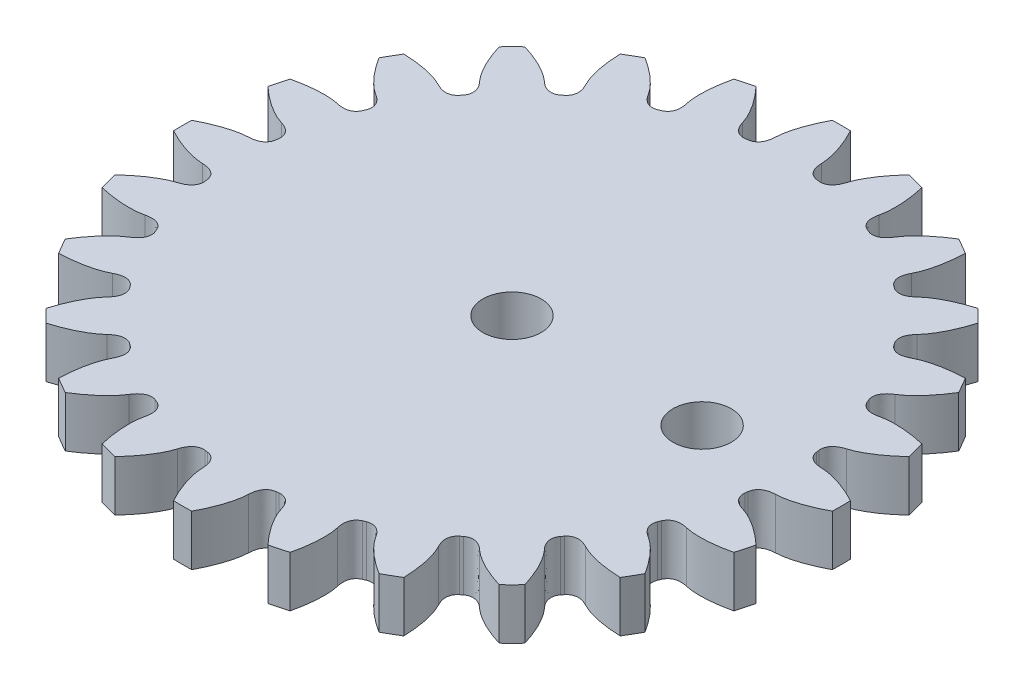
from build123d import *

# Parameters (mm, degrees)
SKETCH_1_R      = 1.15
EXTRUDE_1_DEPTH = 2


with BuildPart() as part:
    # Эскиз1 → Бобышка-Вытянуть1 (new body)
    with BuildSketch(Plane(origin=(0, 0, 0), x_dir=(1, 0, 0), z_dir=(0, 1, 0))):
        with BuildLine():
            ThreePointArc((0.357730054, 12.995077114), (0, 13), (-0.357730054, 12.995077114))
            add(Edge.make_bspline(
                [(-0.905776829, 11.30170004), (-0.903153797, 11.364174343), (-0.897985909, 11.426330365), (-0.890273167, 11.488168106), (-0.882433861, 11.551020594), (-0.871236283, 11.61359405), (-0.858868063, 11.675739131), (-0.846302347, 11.73887655), (-0.831417931, 11.801647657), (-0.815287884, 11.863979043), (-0.798904868, 11.927287976), (-0.780635548, 11.990183506), (-0.761176822, 12.052620709), (-0.741417879, 12.116021219), (-0.720022631, 12.178974672), (-0.697502256, 12.241450826), (-0.67463984, 12.304875873), (-0.650308122, 12.367826515), (-0.624909495, 12.430281414), (-0.599130965, 12.493670489), (-0.572004587, 12.556561325), (-0.543862193, 12.618938569), (-0.515305116, 12.682234954), (-0.485493692, 12.745011445), (-0.45471074, 12.807257013), (-0.423480821, 12.870406383), (-0.391153926, 12.933013083), (-0.357730054, 12.995077114)],
                knots=[0, 0, 0, 0, 1, 1, 1, 2, 2, 2, 3, 3, 3, 4, 4, 4, 5, 5, 5, 6, 6, 6, 7, 7, 7, 8, 8, 8, 9, 9, 9, 9], degree=3))
            add(Edge.make_bspline(
                [(-0.905776829, 11.30170004), (-0.905771657, 11.23039326), (-0.913828063, 11.160800255), (-0.929946047, 11.092921025), (-0.939606651, 11.052236386), (-0.951337627, 11.011263415), (-0.96761603, 10.972714088), (-0.979860318, 10.943718059), (-0.994015249, 10.915028809), (-1.010665897, 10.888305341), (-1.024787349, 10.865641106), (-1.040586182, 10.843617085), (-1.057994763, 10.823361181), (-1.073764387, 10.8050123), (-1.090989796, 10.787535026), (-1.10932187, 10.771741608), (-1.126572142, 10.756880182), (-1.145069758, 10.743071473), (-1.164321541, 10.730911074), (-1.182867326, 10.719196619), (-1.202457761, 10.708685073), (-1.222516171, 10.6998039), (-1.242144834, 10.691113003), (-1.262615206, 10.683752451), (-1.283298802, 10.67800565), (-1.303777222, 10.672315856), (-1.324670017, 10.668115352), (-1.345977185, 10.665404138)],
                knots=[0, 0, 0, 0, 1, 1, 1, 2, 2, 2, 3, 3, 3, 4, 4, 4, 5, 5, 5, 6, 6, 6, 7, 7, 7, 8, 8, 8, 9, 9, 9, 9], degree=3))
            ThreePointArc((-1.345977185, 10.665404138), (-1.403156566, 10.65803226), (-1.46029559, 10.650353834))
            add(Edge.make_bspline(
                [(-2.05018198, 11.151036243), (-2.031731423, 11.082157845), (-2.005937537, 11.017021315), (-1.972800323, 10.955626655), (-1.952938937, 10.91882866), (-1.931003099, 10.882288009), (-1.905302069, 10.849265379), (-1.88597027, 10.824426421), (-1.864872333, 10.800378299), (-1.8418725, 10.778874916), (-1.822366288, 10.760637847), (-1.801405552, 10.743453315), (-1.77934754, 10.728393287), (-1.759366213, 10.714751107), (-1.738204295, 10.702327621), (-1.716409234, 10.69181704), (-1.69590033, 10.681926704), (-1.674459048, 10.673376051), (-1.652715911, 10.666612735), (-1.631770134, 10.660097443), (-1.610126638, 10.655014447), (-1.588453086, 10.651627391), (-1.567243883, 10.648312902), (-1.545565971, 10.646501276), (-1.52409977, 10.646303601), (-1.502846508, 10.646107887), (-1.481578448, 10.647457965), (-1.46029559, 10.650353834)],
                knots=[0, 0, 0, 0, 1, 1, 1, 2, 2, 2, 3, 3, 3, 4, 4, 4, 5, 5, 5, 6, 6, 6, 7, 7, 7, 8, 8, 8, 9, 9, 9, 9], degree=3))
            add(Edge.make_bspline(
                [(-2.05018198, 11.151036243), (-2.068885174, 11.210702895), (-2.089964133, 11.269403455), (-2.113418854, 11.327137921), (-2.137258464, 11.385819801), (-2.164269696, 11.443362972), (-2.192300809, 11.50018938), (-2.220779525, 11.557923196), (-2.251403125, 11.614703059), (-2.283116104, 11.670735792), (-2.31532644, 11.727647289), (-2.349251809, 11.783671257), (-2.384207432, 11.838944675), (-2.419702365, 11.895070875), (-2.45666214, 11.950341743), (-2.494585171, 12.004860372), (-2.533084179, 12.060207035), (-2.572879639, 12.114715173), (-2.613577346, 12.168468325), (-2.654883793, 12.223025495), (-2.697363208, 12.276752555), (-2.740691092, 12.329720558), (-2.784657421, 12.383469055), (-2.829700796, 12.436390725), (-2.875545183, 12.488548112), (-2.922055228, 12.541462822), (-2.969484417, 12.593569434), (-3.017832751, 12.64486795)],
                knots=[0, 0, 0, 0, 1, 1, 1, 2, 2, 2, 3, 3, 3, 4, 4, 4, 5, 5, 5, 6, 6, 6, 7, 7, 7, 8, 8, 8, 9, 9, 9, 9], degree=3))
            ThreePointArc((-3.017832751, 12.64486795), (-3.364647586, 12.557035742), (-3.708914148, 12.459693248))
            add(Edge.make_bspline(
                [(-3.800008445, 10.682171655), (-3.813644329, 10.743196089), (-3.824739696, 10.804571744), (-3.833294544, 10.866298619), (-3.841989776, 10.929038422), (-3.847368949, 10.992377886), (-3.851506497, 11.055606556), (-3.855710113, 11.119844866), (-3.857579229, 11.184329469), (-3.85813135, 11.248711729), (-3.85869213, 11.314103698), (-3.857323882, 11.379584563), (-3.854688134, 11.444930559), (-3.85201172, 11.51128474), (-3.847639049, 11.577630603), (-3.842056056, 11.643806636), (-3.836388268, 11.710987756), (-3.829178458, 11.778090919), (-3.820809786, 11.844991368), (-3.812315939, 11.912892486), (-3.802391216, 11.980661192), (-3.791352169, 12.048196771), (-3.78015046, 12.116727499), (-3.767602588, 12.185080697), (-3.753978878, 12.253172513), (-3.740157352, 12.322253018), (-3.725135776, 12.391093263), (-3.708914148, 12.459693248)],
                knots=[0, 0, 0, 0, 1, 1, 1, 2, 2, 2, 3, 3, 3, 4, 4, 4, 5, 5, 5, 6, 6, 6, 7, 7, 7, 8, 8, 8, 9, 9, 9, 9], degree=3))
            add(Edge.make_bspline(
                [(-3.800008445, 10.682171655), (-3.781547896, 10.613295934), (-3.771317792, 10.543989102), (-3.769318131, 10.474251159), (-3.768119598, 10.432452467), (-3.768846266, 10.389839417), (-3.774592696, 10.348390465), (-3.778915046, 10.317213397), (-3.785162334, 10.285838144), (-3.794329082, 10.255715751), (-3.802103423, 10.23016888), (-3.811663687, 10.204806271), (-3.823236471, 10.180734898), (-3.833719719, 10.158929761), (-3.845834734, 10.137589747), (-3.859454521, 10.117589786), (-3.872270584, 10.098770052), (-3.886563952, 10.080644328), (-3.902012404, 10.063915557), (-3.916894333, 10.047800259), (-3.933096651, 10.032576508), (-3.95017297, 10.018806455), (-3.966883434, 10.005331422), (-3.984751244, 9.992923552), (-4.003242682, 9.98201926), (-4.02155069, 9.971223136), (-4.040644409, 9.961758307), (-4.060523839, 9.953624775)],
                knots=[0, 0, 0, 0, 1, 1, 1, 2, 2, 2, 3, 3, 3, 4, 4, 4, 5, 5, 5, 6, 6, 6, 7, 7, 7, 8, 8, 8, 9, 9, 9, 9], degree=3))
            ThreePointArc((-4.060523839, 9.953624775), (-4.113846898, 9.931704974), (-4.167051634, 9.909499517))
            add(Edge.make_bspline(
                [(-4.866424275, 10.240447755), (-4.830775365, 10.178691686), (-4.78900181, 10.122450579), (-4.741103611, 10.071724433), (-4.712394964, 10.041320804), (-4.681749155, 10.011702659), (-4.648376981, 9.986457164), (-4.623275101, 9.96746801), (-4.596671947, 9.949699856), (-4.568890329, 9.934881978), (-4.545328675, 9.922314901), (-4.520634474, 9.911140955), (-4.495430249, 9.902303119), (-4.472598913, 9.894297334), (-4.448942635, 9.887774275), (-4.425169884, 9.883262811), (-4.402799996, 9.879017574), (-4.379876237, 9.876307689), (-4.357123505, 9.875402366), (-4.335205155, 9.874530243), (-4.312983568, 9.875222195), (-4.29117189, 9.877560078), (-4.26982752, 9.879847873), (-4.248419382, 9.883708634), (-4.227633462, 9.889073556), (-4.207053733, 9.89438526), (-4.18685979, 9.901193914), (-4.167051634, 9.909499517)],
                knots=[0, 0, 0, 0, 1, 1, 1, 2, 2, 2, 3, 3, 3, 4, 4, 4, 5, 5, 5, 6, 6, 6, 7, 7, 7, 8, 8, 8, 9, 9, 9, 9], degree=3))
            add(Edge.make_bspline(
                [(-4.866424275, 10.240447755), (-4.89993304, 10.293240572), (-4.935486573, 10.344485323), (-4.973084874, 10.394182006), (-5.011300156, 10.444694204), (-5.052284271, 10.493285618), (-5.094068004, 10.540920727), (-5.136518943, 10.589316478), (-5.180794779, 10.636235643), (-5.225929503, 10.682151183), (-5.271772077, 10.72878682), (-5.319041538, 10.774121286), (-5.36711189, 10.818464127), (-5.415923891, 10.863491108), (-5.465929446, 10.907312773), (-5.51667074, 10.950158522), (-5.568182697, 10.993655017), (-5.620729904, 11.036006012), (-5.67395321, 11.077394228), (-5.727972608, 11.119401513), (-5.782910159, 11.160303386), (-5.838470809, 11.200252466), (-5.894850156, 11.240790204), (-5.952055852, 11.280250529), (-6.009837454, 11.318765296), (-6.068458042, 11.357839295), (-6.127757305, 11.39589484), (-6.187735242, 11.432931932)],
                knots=[0, 0, 0, 0, 1, 1, 1, 2, 2, 2, 3, 3, 3, 4, 4, 4, 5, 5, 5, 6, 6, 6, 7, 7, 7, 8, 8, 8, 9, 9, 9, 9], degree=3))
            ThreePointArc((-6.187735242, 11.432931932), (-6.5, 11.258330249), (-6.807341872, 11.075201878))
            add(Edge.make_bspline(
                [(-6.435275764, 9.334670926), (-6.464241303, 9.390086775), (-6.490843792, 9.446499413), (-6.515083232, 9.503908839), (-6.539720437, 9.562260343), (-6.561309779, 9.622049335), (-6.581671127, 9.682052664), (-6.602357607, 9.743014131), (-6.620852878, 9.804817712), (-6.63804954, 9.866863299), (-6.655515899, 9.929881951), (-6.671141968, 9.993485738), (-6.685508819, 10.057287305), (-6.700097328, 10.122073229), (-6.713045225, 10.187290142), (-6.724780086, 10.252656266), (-6.736693176, 10.319015177), (-6.747096611, 10.385697891), (-6.756328205, 10.452484734), (-6.765697881, 10.520270548), (-6.773651166, 10.588298798), (-6.78046776, 10.656390273), (-6.787384798, 10.725485089), (-6.792955594, 10.794756837), (-6.797419559, 10.864054556), (-6.801948341, 10.934358474), (-6.805255778, 11.004740914), (-6.807341872, 11.075201878)],
                knots=[0, 0, 0, 0, 1, 1, 1, 2, 2, 2, 3, 3, 3, 4, 4, 4, 5, 5, 5, 6, 6, 6, 7, 7, 7, 8, 8, 8, 9, 9, 9, 9], degree=3))
            add(Edge.make_bspline(
                [(-6.435275764, 9.334670926), (-6.399617895, 9.272920029), (-6.371798445, 9.208622516), (-6.351817413, 9.141778386), (-6.339841422, 9.101714154), (-6.32951426, 9.060365032), (-6.324337108, 9.018841134), (-6.320442957, 8.987607692), (-6.318356862, 8.955684607), (-6.319415012, 8.924216081), (-6.320312431, 8.897527551), (-6.322982611, 8.870554774), (-6.327930932, 8.844308356), (-6.332413387, 8.820532946), (-6.338592391, 8.796784479), (-6.346571724, 8.773940941), (-6.354080185, 8.752445432), (-6.363195236, 8.731237931), (-6.373787569, 8.711080826), (-6.383991463, 8.691662917), (-6.395701505, 8.672764433), (-6.40863201, 8.655043907), (-6.421285484, 8.637703038), (-6.435333069, 8.621093427), (-6.450372188, 8.605774754), (-6.465262123, 8.590608037), (-6.481255562, 8.576523897), (-6.498352504, 8.563522332)],
                knots=[0, 0, 0, 0, 1, 1, 1, 2, 2, 2, 3, 3, 3, 4, 4, 4, 5, 5, 5, 6, 6, 6, 7, 7, 7, 8, 8, 8, 9, 9, 9, 9], degree=3))
            ThreePointArc((-6.498352504, 8.563522332), (-6.544185362, 8.528548408), (-6.589829995, 8.493329185))
            add(Edge.make_bspline(
                [(-7.351027799, 8.631989675), (-7.300609948, 8.581564511), (-7.245703523, 8.538051564), (-7.186308524, 8.501450836), (-7.150709061, 8.47951353), (-7.113441743, 8.458836318), (-7.074672683, 8.443088397), (-7.045511375, 8.431243127), (-7.015215964, 8.420965811), (-6.984545833, 8.413843251), (-6.958534424, 8.407802592), (-6.931789628, 8.403400719), (-6.905156815, 8.401387358), (-6.881031389, 8.399563548), (-6.856492887, 8.399385452), (-6.83236252, 8.401180553), (-6.80965612, 8.402869722), (-6.786812099, 8.40618528), (-6.764600332, 8.411199646), (-6.74320311, 8.416030126), (-6.721917795, 8.42244987), (-6.701454421, 8.430353369), (-6.681429467, 8.438087539), (-6.661750033, 8.447357581), (-6.64306092, 8.45791949), (-6.624557198, 8.468376628), (-6.606813556, 8.480179859), (-6.589829995, 8.493329185)],
                knots=[0, 0, 0, 0, 1, 1, 1, 2, 2, 2, 3, 3, 3, 4, 4, 4, 5, 5, 5, 6, 6, 6, 7, 7, 7, 8, 8, 8, 9, 9, 9, 9], degree=3))
            add(Edge.make_bspline(
                [(-7.351027799, 8.631989675), (-7.397058566, 8.674310914), (-7.444663759, 8.714607611), (-7.493843377, 8.752879765), (-7.543830025, 8.791779958), (-7.595994023, 8.828108191), (-7.648682883, 8.863305747), (-7.702213083, 8.89906534), (-7.75712383, 8.932926344), (-7.812604442, 8.965595625), (-7.868955159, 8.998777259), (-7.926347375, 9.030332754), (-7.984256542, 9.060723127), (-8.043059155, 9.091582375), (-8.102702693, 9.120968463), (-8.162804316, 9.149221466), (-8.223818766, 9.177903577), (-8.285536715, 9.20521128), (-8.347658539, 9.231414022), (-8.410709557, 9.258008693), (-8.474361339, 9.283297984), (-8.538368389, 9.307505679), (-8.603318594, 9.332070078), (-8.668788137, 9.355379901), (-8.734569235, 9.37762733), (-8.801305469, 9.40019779), (-8.868433658, 9.421608846), (-8.935953802, 9.441860497)],
                knots=[0, 0, 0, 0, 1, 1, 1, 2, 2, 2, 3, 3, 3, 4, 4, 4, 5, 5, 5, 6, 6, 6, 7, 7, 7, 8, 8, 8, 9, 9, 9, 9], degree=3))
            ThreePointArc((-8.935953802, 9.441860497), (-9.192388155, 9.192388155), (-9.441860497, 8.935953802))
            add(Edge.make_bspline(
                [(-8.631989675, 7.351027799), (-8.674310914, 7.397058566), (-8.714607611, 7.444663759), (-8.752879765, 7.493843377), (-8.791779958, 7.543830025), (-8.828108191, 7.595994023), (-8.863305747, 7.648682883), (-8.89906534, 7.702213083), (-8.932926344, 7.75712383), (-8.965595625, 7.812604442), (-8.998777259, 7.868955159), (-9.030332754, 7.926347375), (-9.060723127, 7.984256542), (-9.091582375, 8.043059155), (-9.120968463, 8.102702693), (-9.149221466, 8.162804316), (-9.177903577, 8.223818766), (-9.20521128, 8.285536715), (-9.231414022, 8.347658539), (-9.258008693, 8.410709557), (-9.283297984, 8.474361339), (-9.307505679, 8.538368389), (-9.332070078, 8.603318594), (-9.355379901, 8.668788137), (-9.37762733, 8.734569235), (-9.40019779, 8.801305469), (-9.421608846, 8.868433658), (-9.441860497, 8.935953802)],
                knots=[0, 0, 0, 0, 1, 1, 1, 2, 2, 2, 3, 3, 3, 4, 4, 4, 5, 5, 5, 6, 6, 6, 7, 7, 7, 8, 8, 8, 9, 9, 9, 9], degree=3))
            add(Edge.make_bspline(
                [(-8.631989675, 7.351027799), (-8.581564511, 7.300609948), (-8.538051564, 7.245703523), (-8.501450836, 7.186308524), (-8.47951353, 7.150709061), (-8.458836318, 7.113441743), (-8.443088397, 7.074672683), (-8.431243127, 7.045511375), (-8.420965811, 7.015215964), (-8.413843251, 6.984545833), (-8.407802592, 6.958534424), (-8.403400719, 6.931789628), (-8.401387358, 6.905156815), (-8.399563548, 6.881031389), (-8.399385452, 6.856492887), (-8.401180553, 6.83236252), (-8.402869722, 6.80965612), (-8.40618528, 6.786812099), (-8.411199646, 6.764600332), (-8.416030126, 6.74320311), (-8.42244987, 6.721917795), (-8.430353369, 6.701454421), (-8.438087539, 6.681429467), (-8.447357581, 6.661750033), (-8.45791949, 6.64306092), (-8.468376628, 6.624557198), (-8.480179859, 6.606813556), (-8.493329185, 6.589829995)],
                knots=[0, 0, 0, 0, 1, 1, 1, 2, 2, 2, 3, 3, 3, 4, 4, 4, 5, 5, 5, 6, 6, 6, 7, 7, 7, 8, 8, 8, 9, 9, 9, 9], degree=3))
            ThreePointArc((-8.493329185, 6.589829995), (-8.528548408, 6.544185362), (-8.563522332, 6.498352504))
            add(Edge.make_bspline(
                [(-9.334670926, 6.435275764), (-9.272920029, 6.399617895), (-9.208622516, 6.371798445), (-9.141778386, 6.351817413), (-9.101714154, 6.339841422), (-9.060365032, 6.32951426), (-9.018841134, 6.324337108), (-8.987607692, 6.320442957), (-8.955684607, 6.318356862), (-8.924216081, 6.319415012), (-8.897527551, 6.320312431), (-8.870554774, 6.322982611), (-8.844308356, 6.327930932), (-8.820532946, 6.332413387), (-8.796784479, 6.338592391), (-8.773940941, 6.346571724), (-8.752445432, 6.354080185), (-8.731237931, 6.363195236), (-8.711080826, 6.373787569), (-8.691662917, 6.383991463), (-8.672764433, 6.395701505), (-8.655043907, 6.40863201), (-8.637703038, 6.421285484), (-8.621093427, 6.435333069), (-8.605774754, 6.450372188), (-8.590608037, 6.465262123), (-8.576523897, 6.481255562), (-8.563522332, 6.498352504)],
                knots=[0, 0, 0, 0, 1, 1, 1, 2, 2, 2, 3, 3, 3, 4, 4, 4, 5, 5, 5, 6, 6, 6, 7, 7, 7, 8, 8, 8, 9, 9, 9, 9], degree=3))
            add(Edge.make_bspline(
                [(-9.334670926, 6.435275764), (-9.390086775, 6.464241303), (-9.446499413, 6.490843792), (-9.503908839, 6.515083232), (-9.562260343, 6.539720437), (-9.622049335, 6.561309779), (-9.682052664, 6.581671127), (-9.743014131, 6.602357607), (-9.804817712, 6.620852878), (-9.866863299, 6.63804954), (-9.929881951, 6.655515899), (-9.993485738, 6.671141968), (-10.057287305, 6.685508819), (-10.122073229, 6.700097328), (-10.187290142, 6.713045225), (-10.252656266, 6.724780086), (-10.319015177, 6.736693176), (-10.385697891, 6.747096611), (-10.452484734, 6.756328205), (-10.520270548, 6.765697881), (-10.588298798, 6.773651166), (-10.656390273, 6.78046776), (-10.725485089, 6.787384798), (-10.794756837, 6.792955594), (-10.864054556, 6.797419559), (-10.934358474, 6.801948341), (-11.004740914, 6.805255778), (-11.075201878, 6.807341872)],
                knots=[0, 0, 0, 0, 1, 1, 1, 2, 2, 2, 3, 3, 3, 4, 4, 4, 5, 5, 5, 6, 6, 6, 7, 7, 7, 8, 8, 8, 9, 9, 9, 9], degree=3))
            ThreePointArc((-11.075201878, 6.807341872), (-11.258330249, 6.5), (-11.432931932, 6.187735242))
            add(Edge.make_bspline(
                [(-10.240447755, 4.866424275), (-10.293240572, 4.89993304), (-10.344485323, 4.935486573), (-10.394182006, 4.973084874), (-10.444694204, 5.011300156), (-10.493285618, 5.052284271), (-10.540920727, 5.094068004), (-10.589316478, 5.136518943), (-10.636235643, 5.180794779), (-10.682151183, 5.225929503), (-10.72878682, 5.271772077), (-10.774121286, 5.319041538), (-10.818464127, 5.36711189), (-10.863491108, 5.415923891), (-10.907312773, 5.465929446), (-10.950158522, 5.51667074), (-10.993655017, 5.568182697), (-11.036006012, 5.620729904), (-11.077394228, 5.67395321), (-11.119401513, 5.727972608), (-11.160303386, 5.782910159), (-11.200252466, 5.838470809), (-11.240790204, 5.894850156), (-11.280250529, 5.952055852), (-11.318765296, 6.009837454), (-11.357839295, 6.068458042), (-11.39589484, 6.127757305), (-11.432931932, 6.187735242)],
                knots=[0, 0, 0, 0, 1, 1, 1, 2, 2, 2, 3, 3, 3, 4, 4, 4, 5, 5, 5, 6, 6, 6, 7, 7, 7, 8, 8, 8, 9, 9, 9, 9], degree=3))
            add(Edge.make_bspline(
                [(-10.240447755, 4.866424275), (-10.178691686, 4.830775365), (-10.122450579, 4.78900181), (-10.071724433, 4.741103611), (-10.041320804, 4.712394964), (-10.011702659, 4.681749155), (-9.986457164, 4.648376981), (-9.96746801, 4.623275101), (-9.949699856, 4.596671947), (-9.934881978, 4.568890329), (-9.922314901, 4.545328675), (-9.911140955, 4.520634474), (-9.902303119, 4.495430249), (-9.894297334, 4.472598913), (-9.887774275, 4.448942635), (-9.883262811, 4.425169884), (-9.879017574, 4.402799996), (-9.876307689, 4.379876237), (-9.875402366, 4.357123505), (-9.874530243, 4.335205155), (-9.875222195, 4.312983568), (-9.877560078, 4.29117189), (-9.879847873, 4.26982752), (-9.883708634, 4.248419382), (-9.889073556, 4.227633462), (-9.89438526, 4.207053733), (-9.901193914, 4.18685979), (-9.909499517, 4.167051634)],
                knots=[0, 0, 0, 0, 1, 1, 1, 2, 2, 2, 3, 3, 3, 4, 4, 4, 5, 5, 5, 6, 6, 6, 7, 7, 7, 8, 8, 8, 9, 9, 9, 9], degree=3))
            ThreePointArc((-9.909499517, 4.167051634), (-9.931704974, 4.113846898), (-9.953624775, 4.060523839))
            add(Edge.make_bspline(
                [(-10.682171655, 3.800008445), (-10.613295934, 3.781547896), (-10.543989102, 3.771317792), (-10.474251159, 3.769318131), (-10.432452467, 3.768119598), (-10.389839417, 3.768846266), (-10.348390465, 3.774592696), (-10.317213397, 3.778915046), (-10.285838144, 3.785162334), (-10.255715751, 3.794329082), (-10.23016888, 3.802103423), (-10.204806271, 3.811663687), (-10.180734898, 3.823236471), (-10.158929761, 3.833719719), (-10.137589747, 3.845834734), (-10.117589786, 3.859454521), (-10.098770052, 3.872270584), (-10.080644328, 3.886563952), (-10.063915557, 3.902012404), (-10.047800259, 3.916894333), (-10.032576508, 3.933096651), (-10.018806455, 3.95017297), (-10.005331422, 3.966883434), (-9.992923552, 3.984751244), (-9.98201926, 4.003242682), (-9.971223136, 4.02155069), (-9.961758307, 4.040644409), (-9.953624775, 4.060523839)],
                knots=[0, 0, 0, 0, 1, 1, 1, 2, 2, 2, 3, 3, 3, 4, 4, 4, 5, 5, 5, 6, 6, 6, 7, 7, 7, 8, 8, 8, 9, 9, 9, 9], degree=3))
            add(Edge.make_bspline(
                [(-10.682171655, 3.800008445), (-10.743196089, 3.813644329), (-10.804571744, 3.824739696), (-10.866298619, 3.833294544), (-10.929038422, 3.841989776), (-10.992377886, 3.847368949), (-11.055606556, 3.851506497), (-11.119844866, 3.855710113), (-11.184329469, 3.857579229), (-11.248711729, 3.85813135), (-11.314103698, 3.85869213), (-11.379584563, 3.857323882), (-11.444930559, 3.854688134), (-11.51128474, 3.85201172), (-11.577630603, 3.847639049), (-11.643806636, 3.842056056), (-11.710987756, 3.836388268), (-11.778090919, 3.829178458), (-11.844991368, 3.820809786), (-11.912892486, 3.812315939), (-11.980661192, 3.802391216), (-12.048196771, 3.791352169), (-12.116727499, 3.78015046), (-12.185080697, 3.767602588), (-12.253172513, 3.753978878), (-12.322253018, 3.740157352), (-12.391093263, 3.725135776), (-12.459693248, 3.708914148)],
                knots=[0, 0, 0, 0, 1, 1, 1, 2, 2, 2, 3, 3, 3, 4, 4, 4, 5, 5, 5, 6, 6, 6, 7, 7, 7, 8, 8, 8, 9, 9, 9, 9], degree=3))
            ThreePointArc((-12.459693248, 3.708914148), (-12.557035742, 3.364647586), (-12.64486795, 3.017832751))
            add(Edge.make_bspline(
                [(-11.151036243, 2.05018198), (-11.210702895, 2.068885174), (-11.269403455, 2.089964133), (-11.327137921, 2.113418854), (-11.385819801, 2.137258464), (-11.443362972, 2.164269696), (-11.50018938, 2.192300809), (-11.557923196, 2.220779525), (-11.614703059, 2.251403125), (-11.670735792, 2.283116104), (-11.727647289, 2.31532644), (-11.783671257, 2.349251809), (-11.838944675, 2.384207432), (-11.895070875, 2.419702365), (-11.950341743, 2.45666214), (-12.004860372, 2.494585171), (-12.060207035, 2.533084179), (-12.114715173, 2.572879639), (-12.168468325, 2.613577346), (-12.223025495, 2.654883793), (-12.276752555, 2.697363208), (-12.329720558, 2.740691092), (-12.383469055, 2.784657421), (-12.436390725, 2.829700796), (-12.488548112, 2.875545183), (-12.541462822, 2.922055228), (-12.593569434, 2.969484417), (-12.64486795, 3.017832751)],
                knots=[0, 0, 0, 0, 1, 1, 1, 2, 2, 2, 3, 3, 3, 4, 4, 4, 5, 5, 5, 6, 6, 6, 7, 7, 7, 8, 8, 8, 9, 9, 9, 9], degree=3))
            add(Edge.make_bspline(
                [(-11.151036243, 2.05018198), (-11.082157845, 2.031731423), (-11.017021315, 2.005937537), (-10.955626655, 1.972800323), (-10.91882866, 1.952938937), (-10.882288009, 1.931003099), (-10.849265379, 1.905302069), (-10.824426421, 1.88597027), (-10.800378299, 1.864872333), (-10.778874916, 1.8418725), (-10.760637847, 1.822366288), (-10.743453315, 1.801405552), (-10.728393287, 1.77934754), (-10.714751107, 1.759366213), (-10.702327621, 1.738204295), (-10.69181704, 1.716409234), (-10.681926704, 1.69590033), (-10.673376051, 1.674459048), (-10.666612735, 1.652715911), (-10.660097443, 1.631770134), (-10.655014447, 1.610126638), (-10.651627391, 1.588453086), (-10.648312902, 1.567243883), (-10.646501276, 1.545565971), (-10.646303601, 1.52409977), (-10.646107887, 1.502846508), (-10.647457965, 1.481578448), (-10.650353834, 1.46029559)],
                knots=[0, 0, 0, 0, 1, 1, 1, 2, 2, 2, 3, 3, 3, 4, 4, 4, 5, 5, 5, 6, 6, 6, 7, 7, 7, 8, 8, 8, 9, 9, 9, 9], degree=3))
            ThreePointArc((-10.650353834, 1.46029559), (-10.65803226, 1.403156566), (-10.665404138, 1.345977185))
            add(Edge.make_bspline(
                [(-11.30170004, 0.905776829), (-11.23039326, 0.905771657), (-11.160800255, 0.913828063), (-11.092921025, 0.929946047), (-11.052236386, 0.939606651), (-11.011263415, 0.951337627), (-10.972714088, 0.96761603), (-10.943718059, 0.979860318), (-10.915028809, 0.994015249), (-10.888305341, 1.010665897), (-10.865641106, 1.024787349), (-10.843617085, 1.040586182), (-10.823361181, 1.057994763), (-10.8050123, 1.073764387), (-10.787535026, 1.090989796), (-10.771741608, 1.10932187), (-10.756880182, 1.126572142), (-10.743071473, 1.145069758), (-10.730911074, 1.164321541), (-10.719196619, 1.182867326), (-10.708685073, 1.202457761), (-10.6998039, 1.222516171), (-10.691113003, 1.242144834), (-10.683752451, 1.262615206), (-10.67800565, 1.283298802), (-10.672315856, 1.303777222), (-10.668115352, 1.324670017), (-10.665404138, 1.345977185)],
                knots=[0, 0, 0, 0, 1, 1, 1, 2, 2, 2, 3, 3, 3, 4, 4, 4, 5, 5, 5, 6, 6, 6, 7, 7, 7, 8, 8, 8, 9, 9, 9, 9], degree=3))
            add(Edge.make_bspline(
                [(-11.30170004, 0.905776829), (-11.364174343, 0.903153797), (-11.426330365, 0.897985909), (-11.488168106, 0.890273167), (-11.551020594, 0.882433861), (-11.61359405, 0.871236283), (-11.675739131, 0.858868063), (-11.73887655, 0.846302347), (-11.801647657, 0.831417931), (-11.863979043, 0.815287884), (-11.927287976, 0.798904868), (-11.990183506, 0.780635548), (-12.052620709, 0.761176822), (-12.116021219, 0.741417879), (-12.178974672, 0.720022631), (-12.241450826, 0.697502256), (-12.304875873, 0.67463984), (-12.367826515, 0.650308122), (-12.430281414, 0.624909495), (-12.493670489, 0.599130965), (-12.556561325, 0.572004587), (-12.618938569, 0.543862193), (-12.682234954, 0.515305116), (-12.745011445, 0.485493692), (-12.807257013, 0.45471074), (-12.870406383, 0.423480821), (-12.933013083, 0.391153926), (-12.995077114, 0.357730054)],
                knots=[0, 0, 0, 0, 1, 1, 1, 2, 2, 2, 3, 3, 3, 4, 4, 4, 5, 5, 5, 6, 6, 6, 7, 7, 7, 8, 8, 8, 9, 9, 9, 9], degree=3))
            ThreePointArc((-12.995077114, 0.357730054), (-13, 0), (-12.995077114, -0.357730054))
            add(Edge.make_bspline(
                [(-11.30170004, -0.905776829), (-11.364174343, -0.903153797), (-11.426330365, -0.897985909), (-11.488168106, -0.890273167), (-11.551020594, -0.882433861), (-11.61359405, -0.871236283), (-11.675739131, -0.858868063), (-11.73887655, -0.846302347), (-11.801647657, -0.831417931), (-11.863979043, -0.815287884), (-11.927287976, -0.798904868), (-11.990183506, -0.780635548), (-12.052620709, -0.761176822), (-12.116021219, -0.741417879), (-12.178974672, -0.720022631), (-12.241450826, -0.697502256), (-12.304875873, -0.67463984), (-12.367826515, -0.650308122), (-12.430281414, -0.624909495), (-12.493670489, -0.599130965), (-12.556561325, -0.572004587), (-12.618938569, -0.543862193), (-12.682234954, -0.515305116), (-12.745011445, -0.485493692), (-12.807257013, -0.45471074), (-12.870406383, -0.423480821), (-12.933013083, -0.391153926), (-12.995077114, -0.357730054)],
                knots=[0, 0, 0, 0, 1, 1, 1, 2, 2, 2, 3, 3, 3, 4, 4, 4, 5, 5, 5, 6, 6, 6, 7, 7, 7, 8, 8, 8, 9, 9, 9, 9], degree=3))
            add(Edge.make_bspline(
                [(-11.30170004, -0.905776829), (-11.23039326, -0.905771657), (-11.160800255, -0.913828063), (-11.092921025, -0.929946047), (-11.052236386, -0.939606651), (-11.011263415, -0.951337627), (-10.972714088, -0.96761603), (-10.943718059, -0.979860318), (-10.915028809, -0.994015249), (-10.888305341, -1.010665897), (-10.865641106, -1.024787349), (-10.843617085, -1.040586182), (-10.823361181, -1.057994763), (-10.8050123, -1.073764387), (-10.787535026, -1.090989796), (-10.771741608, -1.10932187), (-10.756880182, -1.126572142), (-10.743071473, -1.145069758), (-10.730911074, -1.164321541), (-10.719196619, -1.182867326), (-10.708685073, -1.202457761), (-10.6998039, -1.222516171), (-10.691113003, -1.242144834), (-10.683752451, -1.262615206), (-10.67800565, -1.283298802), (-10.672315856, -1.303777222), (-10.668115352, -1.324670017), (-10.665404138, -1.345977185)],
                knots=[0, 0, 0, 0, 1, 1, 1, 2, 2, 2, 3, 3, 3, 4, 4, 4, 5, 5, 5, 6, 6, 6, 7, 7, 7, 8, 8, 8, 9, 9, 9, 9], degree=3))
            ThreePointArc((-10.665404138, -1.345977185), (-10.65803226, -1.403156566), (-10.650353834, -1.46029559))
            add(Edge.make_bspline(
                [(-11.151036243, -2.05018198), (-11.082157845, -2.031731423), (-11.017021315, -2.005937537), (-10.955626655, -1.972800323), (-10.91882866, -1.952938937), (-10.882288009, -1.931003099), (-10.849265379, -1.905302069), (-10.824426421, -1.88597027), (-10.800378299, -1.864872333), (-10.778874916, -1.8418725), (-10.760637847, -1.822366288), (-10.743453315, -1.801405552), (-10.728393287, -1.77934754), (-10.714751107, -1.759366213), (-10.702327621, -1.738204295), (-10.69181704, -1.716409234), (-10.681926704, -1.69590033), (-10.673376051, -1.674459048), (-10.666612735, -1.652715911), (-10.660097443, -1.631770134), (-10.655014447, -1.610126638), (-10.651627391, -1.588453086), (-10.648312902, -1.567243883), (-10.646501276, -1.545565971), (-10.646303601, -1.52409977), (-10.646107887, -1.502846508), (-10.647457965, -1.481578448), (-10.650353834, -1.46029559)],
                knots=[0, 0, 0, 0, 1, 1, 1, 2, 2, 2, 3, 3, 3, 4, 4, 4, 5, 5, 5, 6, 6, 6, 7, 7, 7, 8, 8, 8, 9, 9, 9, 9], degree=3))
            add(Edge.make_bspline(
                [(-11.151036243, -2.05018198), (-11.210702895, -2.068885174), (-11.269403455, -2.089964133), (-11.327137921, -2.113418854), (-11.385819801, -2.137258464), (-11.443362972, -2.164269696), (-11.50018938, -2.192300809), (-11.557923196, -2.220779525), (-11.614703059, -2.251403125), (-11.670735792, -2.283116104), (-11.727647289, -2.31532644), (-11.783671257, -2.349251809), (-11.838944675, -2.384207432), (-11.895070875, -2.419702365), (-11.950341743, -2.45666214), (-12.004860372, -2.494585171), (-12.060207035, -2.533084179), (-12.114715173, -2.572879639), (-12.168468325, -2.613577346), (-12.223025495, -2.654883793), (-12.276752555, -2.697363208), (-12.329720558, -2.740691092), (-12.383469055, -2.784657421), (-12.436390725, -2.829700796), (-12.488548112, -2.875545183), (-12.541462822, -2.922055228), (-12.593569434, -2.969484417), (-12.64486795, -3.017832751)],
                knots=[0, 0, 0, 0, 1, 1, 1, 2, 2, 2, 3, 3, 3, 4, 4, 4, 5, 5, 5, 6, 6, 6, 7, 7, 7, 8, 8, 8, 9, 9, 9, 9], degree=3))
            ThreePointArc((-12.64486795, -3.017832751), (-12.557035742, -3.364647586), (-12.459693248, -3.708914148))
            add(Edge.make_bspline(
                [(-10.682171655, -3.800008445), (-10.743196089, -3.813644329), (-10.804571744, -3.824739696), (-10.866298619, -3.833294544), (-10.929038422, -3.841989776), (-10.992377886, -3.847368949), (-11.055606556, -3.851506497), (-11.119844866, -3.855710113), (-11.184329469, -3.857579229), (-11.248711729, -3.85813135), (-11.314103698, -3.85869213), (-11.379584563, -3.857323882), (-11.444930559, -3.854688134), (-11.51128474, -3.85201172), (-11.577630603, -3.847639049), (-11.643806636, -3.842056056), (-11.710987756, -3.836388268), (-11.778090919, -3.829178458), (-11.844991368, -3.820809786), (-11.912892486, -3.812315939), (-11.980661192, -3.802391216), (-12.048196771, -3.791352169), (-12.116727499, -3.78015046), (-12.185080697, -3.767602588), (-12.253172513, -3.753978878), (-12.322253018, -3.740157352), (-12.391093263, -3.725135776), (-12.459693248, -3.708914148)],
                knots=[0, 0, 0, 0, 1, 1, 1, 2, 2, 2, 3, 3, 3, 4, 4, 4, 5, 5, 5, 6, 6, 6, 7, 7, 7, 8, 8, 8, 9, 9, 9, 9], degree=3))
            add(Edge.make_bspline(
                [(-10.682171655, -3.800008445), (-10.613295934, -3.781547896), (-10.543989102, -3.771317792), (-10.474251159, -3.769318131), (-10.432452467, -3.768119598), (-10.389839417, -3.768846266), (-10.348390465, -3.774592696), (-10.317213397, -3.778915046), (-10.285838144, -3.785162334), (-10.255715751, -3.794329082), (-10.23016888, -3.802103423), (-10.204806271, -3.811663687), (-10.180734898, -3.823236471), (-10.158929761, -3.833719719), (-10.137589747, -3.845834734), (-10.117589786, -3.859454521), (-10.098770052, -3.872270584), (-10.080644328, -3.886563952), (-10.063915557, -3.902012404), (-10.047800259, -3.916894333), (-10.032576508, -3.933096651), (-10.018806455, -3.95017297), (-10.005331422, -3.966883434), (-9.992923552, -3.984751244), (-9.98201926, -4.003242682), (-9.971223136, -4.02155069), (-9.961758307, -4.040644409), (-9.953624775, -4.060523839)],
                knots=[0, 0, 0, 0, 1, 1, 1, 2, 2, 2, 3, 3, 3, 4, 4, 4, 5, 5, 5, 6, 6, 6, 7, 7, 7, 8, 8, 8, 9, 9, 9, 9], degree=3))
            ThreePointArc((-9.953624775, -4.060523839), (-9.931704974, -4.113846898), (-9.909499517, -4.167051634))
            add(Edge.make_bspline(
                [(-10.240447755, -4.866424275), (-10.178691686, -4.830775365), (-10.122450579, -4.78900181), (-10.071724433, -4.741103611), (-10.041320804, -4.712394964), (-10.011702659, -4.681749155), (-9.986457164, -4.648376981), (-9.96746801, -4.623275101), (-9.949699856, -4.596671947), (-9.934881978, -4.568890329), (-9.922314901, -4.545328675), (-9.911140955, -4.520634474), (-9.902303119, -4.495430249), (-9.894297334, -4.472598913), (-9.887774275, -4.448942635), (-9.883262811, -4.425169884), (-9.879017574, -4.402799996), (-9.876307689, -4.379876237), (-9.875402366, -4.357123505), (-9.874530243, -4.335205155), (-9.875222195, -4.312983568), (-9.877560078, -4.29117189), (-9.879847873, -4.26982752), (-9.883708634, -4.248419382), (-9.889073556, -4.227633462), (-9.89438526, -4.207053733), (-9.901193914, -4.18685979), (-9.909499517, -4.167051634)],
                knots=[0, 0, 0, 0, 1, 1, 1, 2, 2, 2, 3, 3, 3, 4, 4, 4, 5, 5, 5, 6, 6, 6, 7, 7, 7, 8, 8, 8, 9, 9, 9, 9], degree=3))
            add(Edge.make_bspline(
                [(-10.240447755, -4.866424275), (-10.293240572, -4.89993304), (-10.344485323, -4.935486573), (-10.394182006, -4.973084874), (-10.444694204, -5.011300156), (-10.493285618, -5.052284271), (-10.540920727, -5.094068004), (-10.589316478, -5.136518943), (-10.636235643, -5.180794779), (-10.682151183, -5.225929503), (-10.72878682, -5.271772077), (-10.774121286, -5.319041538), (-10.818464127, -5.36711189), (-10.863491108, -5.415923891), (-10.907312773, -5.465929446), (-10.950158522, -5.51667074), (-10.993655017, -5.568182697), (-11.036006012, -5.620729904), (-11.077394228, -5.67395321), (-11.119401513, -5.727972608), (-11.160303386, -5.782910159), (-11.200252466, -5.838470809), (-11.240790204, -5.894850156), (-11.280250529, -5.952055852), (-11.318765296, -6.009837454), (-11.357839295, -6.068458042), (-11.39589484, -6.127757305), (-11.432931932, -6.187735242)],
                knots=[0, 0, 0, 0, 1, 1, 1, 2, 2, 2, 3, 3, 3, 4, 4, 4, 5, 5, 5, 6, 6, 6, 7, 7, 7, 8, 8, 8, 9, 9, 9, 9], degree=3))
            ThreePointArc((-11.432931932, -6.187735242), (-11.258330249, -6.5), (-11.075201878, -6.807341872))
            add(Edge.make_bspline(
                [(-9.334670926, -6.435275764), (-9.390086775, -6.464241303), (-9.446499413, -6.490843792), (-9.503908839, -6.515083232), (-9.562260343, -6.539720437), (-9.622049335, -6.561309779), (-9.682052664, -6.581671127), (-9.743014131, -6.602357607), (-9.804817712, -6.620852878), (-9.866863299, -6.63804954), (-9.929881951, -6.655515899), (-9.993485738, -6.671141968), (-10.057287305, -6.685508819), (-10.122073229, -6.700097328), (-10.187290142, -6.713045225), (-10.252656266, -6.724780086), (-10.319015177, -6.736693176), (-10.385697891, -6.747096611), (-10.452484734, -6.756328205), (-10.520270548, -6.765697881), (-10.588298798, -6.773651166), (-10.656390273, -6.78046776), (-10.725485089, -6.787384798), (-10.794756837, -6.792955594), (-10.864054556, -6.797419559), (-10.934358474, -6.801948341), (-11.004740914, -6.805255778), (-11.075201878, -6.807341872)],
                knots=[0, 0, 0, 0, 1, 1, 1, 2, 2, 2, 3, 3, 3, 4, 4, 4, 5, 5, 5, 6, 6, 6, 7, 7, 7, 8, 8, 8, 9, 9, 9, 9], degree=3))
            add(Edge.make_bspline(
                [(-9.334670926, -6.435275764), (-9.272920029, -6.399617895), (-9.208622516, -6.371798445), (-9.141778386, -6.351817413), (-9.101714154, -6.339841422), (-9.060365032, -6.32951426), (-9.018841134, -6.324337108), (-8.987607692, -6.320442957), (-8.955684607, -6.318356862), (-8.924216081, -6.319415012), (-8.897527551, -6.320312431), (-8.870554774, -6.322982611), (-8.844308356, -6.327930932), (-8.820532946, -6.332413387), (-8.796784479, -6.338592391), (-8.773940941, -6.346571724), (-8.752445432, -6.354080185), (-8.731237931, -6.363195236), (-8.711080826, -6.373787569), (-8.691662917, -6.383991463), (-8.672764433, -6.395701505), (-8.655043907, -6.40863201), (-8.637703038, -6.421285484), (-8.621093427, -6.435333069), (-8.605774754, -6.450372188), (-8.590608037, -6.465262123), (-8.576523897, -6.481255562), (-8.563522332, -6.498352504)],
                knots=[0, 0, 0, 0, 1, 1, 1, 2, 2, 2, 3, 3, 3, 4, 4, 4, 5, 5, 5, 6, 6, 6, 7, 7, 7, 8, 8, 8, 9, 9, 9, 9], degree=3))
            ThreePointArc((-8.563522332, -6.498352504), (-8.528548408, -6.544185362), (-8.493329185, -6.589829995))
            add(Edge.make_bspline(
                [(-8.631989675, -7.351027799), (-8.581564511, -7.300609948), (-8.538051564, -7.245703523), (-8.501450836, -7.186308524), (-8.47951353, -7.150709061), (-8.458836318, -7.113441743), (-8.443088397, -7.074672683), (-8.431243127, -7.045511375), (-8.420965811, -7.015215964), (-8.413843251, -6.984545833), (-8.407802592, -6.958534424), (-8.403400719, -6.931789628), (-8.401387358, -6.905156815), (-8.399563548, -6.881031389), (-8.399385452, -6.856492887), (-8.401180553, -6.83236252), (-8.402869722, -6.80965612), (-8.40618528, -6.786812099), (-8.411199646, -6.764600332), (-8.416030126, -6.74320311), (-8.42244987, -6.721917795), (-8.430353369, -6.701454421), (-8.438087539, -6.681429467), (-8.447357581, -6.661750033), (-8.45791949, -6.64306092), (-8.468376628, -6.624557198), (-8.480179859, -6.606813556), (-8.493329185, -6.589829995)],
                knots=[0, 0, 0, 0, 1, 1, 1, 2, 2, 2, 3, 3, 3, 4, 4, 4, 5, 5, 5, 6, 6, 6, 7, 7, 7, 8, 8, 8, 9, 9, 9, 9], degree=3))
            add(Edge.make_bspline(
                [(-8.631989675, -7.351027799), (-8.674310914, -7.397058566), (-8.714607611, -7.444663759), (-8.752879765, -7.493843377), (-8.791779958, -7.543830025), (-8.828108191, -7.595994023), (-8.863305747, -7.648682883), (-8.89906534, -7.702213083), (-8.932926344, -7.75712383), (-8.965595625, -7.812604442), (-8.998777259, -7.868955159), (-9.030332754, -7.926347375), (-9.060723127, -7.984256542), (-9.091582375, -8.043059155), (-9.120968463, -8.102702693), (-9.149221466, -8.162804316), (-9.177903577, -8.223818766), (-9.20521128, -8.285536715), (-9.231414022, -8.347658539), (-9.258008693, -8.410709557), (-9.283297984, -8.474361339), (-9.307505679, -8.538368389), (-9.332070078, -8.603318594), (-9.355379901, -8.668788137), (-9.37762733, -8.734569235), (-9.40019779, -8.801305469), (-9.421608846, -8.868433658), (-9.441860497, -8.935953802)],
                knots=[0, 0, 0, 0, 1, 1, 1, 2, 2, 2, 3, 3, 3, 4, 4, 4, 5, 5, 5, 6, 6, 6, 7, 7, 7, 8, 8, 8, 9, 9, 9, 9], degree=3))
            ThreePointArc((-9.441860497, -8.935953802), (-9.192388155, -9.192388155), (-8.935953802, -9.441860497))
            add(Edge.make_bspline(
                [(-7.351027799, -8.631989675), (-7.397058566, -8.674310914), (-7.444663759, -8.714607611), (-7.493843377, -8.752879765), (-7.543830025, -8.791779958), (-7.595994023, -8.828108191), (-7.648682883, -8.863305747), (-7.702213083, -8.89906534), (-7.75712383, -8.932926344), (-7.812604442, -8.965595625), (-7.868955159, -8.998777259), (-7.926347375, -9.030332754), (-7.984256542, -9.060723127), (-8.043059155, -9.091582375), (-8.102702693, -9.120968463), (-8.162804316, -9.149221466), (-8.223818766, -9.177903577), (-8.285536715, -9.20521128), (-8.347658539, -9.231414022), (-8.410709557, -9.258008693), (-8.474361339, -9.283297984), (-8.538368389, -9.307505679), (-8.603318594, -9.332070078), (-8.668788137, -9.355379901), (-8.734569235, -9.37762733), (-8.801305469, -9.40019779), (-8.868433658, -9.421608846), (-8.935953802, -9.441860497)],
                knots=[0, 0, 0, 0, 1, 1, 1, 2, 2, 2, 3, 3, 3, 4, 4, 4, 5, 5, 5, 6, 6, 6, 7, 7, 7, 8, 8, 8, 9, 9, 9, 9], degree=3))
            add(Edge.make_bspline(
                [(-7.351027799, -8.631989675), (-7.300609948, -8.581564511), (-7.245703523, -8.538051564), (-7.186308524, -8.501450836), (-7.150709061, -8.47951353), (-7.113441743, -8.458836318), (-7.074672683, -8.443088397), (-7.045511375, -8.431243127), (-7.015215964, -8.420965811), (-6.984545833, -8.413843251), (-6.958534424, -8.407802592), (-6.931789628, -8.403400719), (-6.905156815, -8.401387358), (-6.881031389, -8.399563548), (-6.856492887, -8.399385452), (-6.83236252, -8.401180553), (-6.80965612, -8.402869722), (-6.786812099, -8.40618528), (-6.764600332, -8.411199646), (-6.74320311, -8.416030126), (-6.721917795, -8.42244987), (-6.701454421, -8.430353369), (-6.681429467, -8.438087539), (-6.661750033, -8.447357581), (-6.64306092, -8.45791949), (-6.624557198, -8.468376628), (-6.606813556, -8.480179859), (-6.589829995, -8.493329185)],
                knots=[0, 0, 0, 0, 1, 1, 1, 2, 2, 2, 3, 3, 3, 4, 4, 4, 5, 5, 5, 6, 6, 6, 7, 7, 7, 8, 8, 8, 9, 9, 9, 9], degree=3))
            ThreePointArc((-6.589829995, -8.493329185), (-6.544185362, -8.528548408), (-6.498352504, -8.563522332))
            add(Edge.make_bspline(
                [(-6.435275764, -9.334670926), (-6.399617895, -9.272920029), (-6.371798445, -9.208622516), (-6.351817413, -9.141778386), (-6.339841422, -9.101714154), (-6.32951426, -9.060365032), (-6.324337108, -9.018841134), (-6.320442957, -8.987607692), (-6.318356862, -8.955684607), (-6.319415012, -8.924216081), (-6.320312431, -8.897527551), (-6.322982611, -8.870554774), (-6.327930932, -8.844308356), (-6.332413387, -8.820532946), (-6.338592391, -8.796784479), (-6.346571724, -8.773940941), (-6.354080185, -8.752445432), (-6.363195236, -8.731237931), (-6.373787569, -8.711080826), (-6.383991463, -8.691662917), (-6.395701505, -8.672764433), (-6.40863201, -8.655043907), (-6.421285484, -8.637703038), (-6.435333069, -8.621093427), (-6.450372188, -8.605774754), (-6.465262123, -8.590608037), (-6.481255562, -8.576523897), (-6.498352504, -8.563522332)],
                knots=[0, 0, 0, 0, 1, 1, 1, 2, 2, 2, 3, 3, 3, 4, 4, 4, 5, 5, 5, 6, 6, 6, 7, 7, 7, 8, 8, 8, 9, 9, 9, 9], degree=3))
            add(Edge.make_bspline(
                [(-6.435275764, -9.334670926), (-6.464241303, -9.390086775), (-6.490843792, -9.446499413), (-6.515083232, -9.503908839), (-6.539720437, -9.562260343), (-6.561309779, -9.622049335), (-6.581671127, -9.682052664), (-6.602357607, -9.743014131), (-6.620852878, -9.804817712), (-6.63804954, -9.866863299), (-6.655515899, -9.929881951), (-6.671141968, -9.993485738), (-6.685508819, -10.057287305), (-6.700097328, -10.122073229), (-6.713045225, -10.187290142), (-6.724780086, -10.252656266), (-6.736693176, -10.319015177), (-6.747096611, -10.385697891), (-6.756328205, -10.452484734), (-6.765697881, -10.520270548), (-6.773651166, -10.588298798), (-6.78046776, -10.656390273), (-6.787384798, -10.725485089), (-6.792955594, -10.794756837), (-6.797419559, -10.864054556), (-6.801948341, -10.934358474), (-6.805255778, -11.004740914), (-6.807341872, -11.075201878)],
                knots=[0, 0, 0, 0, 1, 1, 1, 2, 2, 2, 3, 3, 3, 4, 4, 4, 5, 5, 5, 6, 6, 6, 7, 7, 7, 8, 8, 8, 9, 9, 9, 9], degree=3))
            ThreePointArc((-6.807341872, -11.075201878), (-6.5, -11.258330249), (-6.187735242, -11.432931932))
            add(Edge.make_bspline(
                [(-4.866424275, -10.240447755), (-4.89993304, -10.293240572), (-4.935486573, -10.344485323), (-4.973084874, -10.394182006), (-5.011300156, -10.444694204), (-5.052284271, -10.493285618), (-5.094068004, -10.540920727), (-5.136518943, -10.589316478), (-5.180794779, -10.636235643), (-5.225929503, -10.682151183), (-5.271772077, -10.72878682), (-5.319041538, -10.774121286), (-5.36711189, -10.818464127), (-5.415923891, -10.863491108), (-5.465929446, -10.907312773), (-5.51667074, -10.950158522), (-5.568182697, -10.993655017), (-5.620729904, -11.036006012), (-5.67395321, -11.077394228), (-5.727972608, -11.119401513), (-5.782910159, -11.160303386), (-5.838470809, -11.200252466), (-5.894850156, -11.240790204), (-5.952055852, -11.280250529), (-6.009837454, -11.318765296), (-6.068458042, -11.357839295), (-6.127757305, -11.39589484), (-6.187735242, -11.432931932)],
                knots=[0, 0, 0, 0, 1, 1, 1, 2, 2, 2, 3, 3, 3, 4, 4, 4, 5, 5, 5, 6, 6, 6, 7, 7, 7, 8, 8, 8, 9, 9, 9, 9], degree=3))
            add(Edge.make_bspline(
                [(-4.866424275, -10.240447755), (-4.830775365, -10.178691686), (-4.78900181, -10.122450579), (-4.741103611, -10.071724433), (-4.712394964, -10.041320804), (-4.681749155, -10.011702659), (-4.648376981, -9.986457164), (-4.623275101, -9.96746801), (-4.596671947, -9.949699856), (-4.568890329, -9.934881978), (-4.545328675, -9.922314901), (-4.520634474, -9.911140955), (-4.495430249, -9.902303119), (-4.472598913, -9.894297334), (-4.448942635, -9.887774275), (-4.425169884, -9.883262811), (-4.402799996, -9.879017574), (-4.379876237, -9.876307689), (-4.357123505, -9.875402366), (-4.335205155, -9.874530243), (-4.312983568, -9.875222195), (-4.29117189, -9.877560078), (-4.26982752, -9.879847873), (-4.248419382, -9.883708634), (-4.227633462, -9.889073556), (-4.207053733, -9.89438526), (-4.18685979, -9.901193914), (-4.167051634, -9.909499517)],
                knots=[0, 0, 0, 0, 1, 1, 1, 2, 2, 2, 3, 3, 3, 4, 4, 4, 5, 5, 5, 6, 6, 6, 7, 7, 7, 8, 8, 8, 9, 9, 9, 9], degree=3))
            ThreePointArc((-4.167051634, -9.909499517), (-4.113846898, -9.931704974), (-4.060523839, -9.953624775))
            add(Edge.make_bspline(
                [(-3.800008445, -10.682171655), (-3.781547896, -10.613295934), (-3.771317792, -10.543989102), (-3.769318131, -10.474251159), (-3.768119598, -10.432452467), (-3.768846266, -10.389839417), (-3.774592696, -10.348390465), (-3.778915046, -10.317213397), (-3.785162334, -10.285838144), (-3.794329082, -10.255715751), (-3.802103423, -10.23016888), (-3.811663687, -10.204806271), (-3.823236471, -10.180734898), (-3.833719719, -10.158929761), (-3.845834734, -10.137589747), (-3.859454521, -10.117589786), (-3.872270584, -10.098770052), (-3.886563952, -10.080644328), (-3.902012404, -10.063915557), (-3.916894333, -10.047800259), (-3.933096651, -10.032576508), (-3.95017297, -10.018806455), (-3.966883434, -10.005331422), (-3.984751244, -9.992923552), (-4.003242682, -9.98201926), (-4.02155069, -9.971223136), (-4.040644409, -9.961758307), (-4.060523839, -9.953624775)],
                knots=[0, 0, 0, 0, 1, 1, 1, 2, 2, 2, 3, 3, 3, 4, 4, 4, 5, 5, 5, 6, 6, 6, 7, 7, 7, 8, 8, 8, 9, 9, 9, 9], degree=3))
            add(Edge.make_bspline(
                [(-3.800008445, -10.682171655), (-3.813644329, -10.743196089), (-3.824739696, -10.804571744), (-3.833294544, -10.866298619), (-3.841989776, -10.929038422), (-3.847368949, -10.992377886), (-3.851506497, -11.055606556), (-3.855710113, -11.119844866), (-3.857579229, -11.184329469), (-3.85813135, -11.248711729), (-3.85869213, -11.314103698), (-3.857323882, -11.379584563), (-3.854688134, -11.444930559), (-3.85201172, -11.51128474), (-3.847639049, -11.577630603), (-3.842056056, -11.643806636), (-3.836388268, -11.710987756), (-3.829178458, -11.778090919), (-3.820809786, -11.844991368), (-3.812315939, -11.912892486), (-3.802391216, -11.980661192), (-3.791352169, -12.048196771), (-3.78015046, -12.116727499), (-3.767602588, -12.185080697), (-3.753978878, -12.253172513), (-3.740157352, -12.322253018), (-3.725135776, -12.391093263), (-3.708914148, -12.459693248)],
                knots=[0, 0, 0, 0, 1, 1, 1, 2, 2, 2, 3, 3, 3, 4, 4, 4, 5, 5, 5, 6, 6, 6, 7, 7, 7, 8, 8, 8, 9, 9, 9, 9], degree=3))
            ThreePointArc((-3.708914148, -12.459693248), (-3.364647586, -12.557035742), (-3.017832751, -12.64486795))
            add(Edge.make_bspline(
                [(-2.05018198, -11.151036243), (-2.068885174, -11.210702895), (-2.089964133, -11.269403455), (-2.113418854, -11.327137921), (-2.137258464, -11.385819801), (-2.164269696, -11.443362972), (-2.192300809, -11.50018938), (-2.220779525, -11.557923196), (-2.251403125, -11.614703059), (-2.283116104, -11.670735792), (-2.31532644, -11.727647289), (-2.349251809, -11.783671257), (-2.384207432, -11.838944675), (-2.419702365, -11.895070875), (-2.45666214, -11.950341743), (-2.494585171, -12.004860372), (-2.533084179, -12.060207035), (-2.572879639, -12.114715173), (-2.613577346, -12.168468325), (-2.654883793, -12.223025495), (-2.697363208, -12.276752555), (-2.740691092, -12.329720558), (-2.784657421, -12.383469055), (-2.829700796, -12.436390725), (-2.875545183, -12.488548112), (-2.922055228, -12.541462822), (-2.969484417, -12.593569434), (-3.017832751, -12.64486795)],
                knots=[0, 0, 0, 0, 1, 1, 1, 2, 2, 2, 3, 3, 3, 4, 4, 4, 5, 5, 5, 6, 6, 6, 7, 7, 7, 8, 8, 8, 9, 9, 9, 9], degree=3))
            add(Edge.make_bspline(
                [(-2.05018198, -11.151036243), (-2.031731423, -11.082157845), (-2.005937537, -11.017021315), (-1.972800323, -10.955626655), (-1.952938937, -10.91882866), (-1.931003099, -10.882288009), (-1.905302069, -10.849265379), (-1.88597027, -10.824426421), (-1.864872333, -10.800378299), (-1.8418725, -10.778874916), (-1.822366288, -10.760637847), (-1.801405552, -10.743453315), (-1.77934754, -10.728393287), (-1.759366213, -10.714751107), (-1.738204295, -10.702327621), (-1.716409234, -10.69181704), (-1.69590033, -10.681926704), (-1.674459048, -10.673376051), (-1.652715911, -10.666612735), (-1.631770134, -10.660097443), (-1.610126638, -10.655014447), (-1.588453086, -10.651627391), (-1.567243883, -10.648312902), (-1.545565971, -10.646501276), (-1.52409977, -10.646303601), (-1.502846508, -10.646107887), (-1.481578448, -10.647457965), (-1.46029559, -10.650353834)],
                knots=[0, 0, 0, 0, 1, 1, 1, 2, 2, 2, 3, 3, 3, 4, 4, 4, 5, 5, 5, 6, 6, 6, 7, 7, 7, 8, 8, 8, 9, 9, 9, 9], degree=3))
            ThreePointArc((-1.46029559, -10.650353834), (-1.403156566, -10.65803226), (-1.345977185, -10.665404138))
            add(Edge.make_bspline(
                [(-0.905776829, -11.30170004), (-0.905771657, -11.23039326), (-0.913828063, -11.160800255), (-0.929946047, -11.092921025), (-0.939606651, -11.052236386), (-0.951337627, -11.011263415), (-0.96761603, -10.972714088), (-0.979860318, -10.943718059), (-0.994015249, -10.915028809), (-1.010665897, -10.888305341), (-1.024787349, -10.865641106), (-1.040586182, -10.843617085), (-1.057994763, -10.823361181), (-1.073764387, -10.8050123), (-1.090989796, -10.787535026), (-1.10932187, -10.771741608), (-1.126572142, -10.756880182), (-1.145069758, -10.743071473), (-1.164321541, -10.730911074), (-1.182867326, -10.719196619), (-1.202457761, -10.708685073), (-1.222516171, -10.6998039), (-1.242144834, -10.691113003), (-1.262615206, -10.683752451), (-1.283298802, -10.67800565), (-1.303777222, -10.672315856), (-1.324670017, -10.668115352), (-1.345977185, -10.665404138)],
                knots=[0, 0, 0, 0, 1, 1, 1, 2, 2, 2, 3, 3, 3, 4, 4, 4, 5, 5, 5, 6, 6, 6, 7, 7, 7, 8, 8, 8, 9, 9, 9, 9], degree=3))
            add(Edge.make_bspline(
                [(-0.905776829, -11.30170004), (-0.903153797, -11.364174343), (-0.897985909, -11.426330365), (-0.890273167, -11.488168106), (-0.882433861, -11.551020594), (-0.871236283, -11.61359405), (-0.858868063, -11.675739131), (-0.846302347, -11.73887655), (-0.831417931, -11.801647657), (-0.815287884, -11.863979043), (-0.798904868, -11.927287976), (-0.780635548, -11.990183506), (-0.761176822, -12.052620709), (-0.741417879, -12.116021219), (-0.720022631, -12.178974672), (-0.697502256, -12.241450826), (-0.67463984, -12.304875873), (-0.650308122, -12.367826515), (-0.624909495, -12.430281414), (-0.599130965, -12.493670489), (-0.572004587, -12.556561325), (-0.543862193, -12.618938569), (-0.515305116, -12.682234954), (-0.485493692, -12.745011445), (-0.45471074, -12.807257013), (-0.423480821, -12.870406383), (-0.391153926, -12.933013083), (-0.357730054, -12.995077114)],
                knots=[0, 0, 0, 0, 1, 1, 1, 2, 2, 2, 3, 3, 3, 4, 4, 4, 5, 5, 5, 6, 6, 6, 7, 7, 7, 8, 8, 8, 9, 9, 9, 9], degree=3))
            ThreePointArc((-0.357730054, -12.995077114), (0, -13), (0.357730054, -12.995077114))
            add(Edge.make_bspline(
                [(0.905776829, -11.30170004), (0.903153797, -11.364174343), (0.897985909, -11.426330365), (0.890273167, -11.488168106), (0.882433861, -11.551020594), (0.871236283, -11.61359405), (0.858868063, -11.675739131), (0.846302347, -11.73887655), (0.831417931, -11.801647657), (0.815287884, -11.863979043), (0.798904868, -11.927287976), (0.780635548, -11.990183506), (0.761176822, -12.052620709), (0.741417879, -12.116021219), (0.720022631, -12.178974672), (0.697502256, -12.241450826), (0.67463984, -12.304875873), (0.650308122, -12.367826515), (0.624909495, -12.430281414), (0.599130965, -12.493670489), (0.572004587, -12.556561325), (0.543862193, -12.618938569), (0.515305116, -12.682234954), (0.485493692, -12.745011445), (0.45471074, -12.807257013), (0.423480821, -12.870406383), (0.391153926, -12.933013083), (0.357730054, -12.995077114)],
                knots=[0, 0, 0, 0, 1, 1, 1, 2, 2, 2, 3, 3, 3, 4, 4, 4, 5, 5, 5, 6, 6, 6, 7, 7, 7, 8, 8, 8, 9, 9, 9, 9], degree=3))
            add(Edge.make_bspline(
                [(0.905776829, -11.30170004), (0.905771657, -11.23039326), (0.913828063, -11.160800255), (0.929946047, -11.092921025), (0.939606651, -11.052236386), (0.951337627, -11.011263415), (0.96761603, -10.972714088), (0.979860318, -10.943718059), (0.994015249, -10.915028809), (1.010665897, -10.888305341), (1.024787349, -10.865641106), (1.040586182, -10.843617085), (1.057994763, -10.823361181), (1.073764387, -10.8050123), (1.090989796, -10.787535026), (1.10932187, -10.771741608), (1.126572142, -10.756880182), (1.145069758, -10.743071473), (1.164321541, -10.730911074), (1.182867326, -10.719196619), (1.202457761, -10.708685073), (1.222516171, -10.6998039), (1.242144834, -10.691113003), (1.262615206, -10.683752451), (1.283298802, -10.67800565), (1.303777222, -10.672315856), (1.324670017, -10.668115352), (1.345977185, -10.665404138)],
                knots=[0, 0, 0, 0, 1, 1, 1, 2, 2, 2, 3, 3, 3, 4, 4, 4, 5, 5, 5, 6, 6, 6, 7, 7, 7, 8, 8, 8, 9, 9, 9, 9], degree=3))
            ThreePointArc((1.345977185, -10.665404138), (1.403156566, -10.65803226), (1.46029559, -10.650353834))
            add(Edge.make_bspline(
                [(2.05018198, -11.151036243), (2.031731423, -11.082157845), (2.005937537, -11.017021315), (1.972800323, -10.955626655), (1.952938937, -10.91882866), (1.931003099, -10.882288009), (1.905302069, -10.849265379), (1.88597027, -10.824426421), (1.864872333, -10.800378299), (1.8418725, -10.778874916), (1.822366288, -10.760637847), (1.801405552, -10.743453315), (1.77934754, -10.728393287), (1.759366213, -10.714751107), (1.738204295, -10.702327621), (1.716409234, -10.69181704), (1.69590033, -10.681926704), (1.674459048, -10.673376051), (1.652715911, -10.666612735), (1.631770134, -10.660097443), (1.610126638, -10.655014447), (1.588453086, -10.651627391), (1.567243883, -10.648312902), (1.545565971, -10.646501276), (1.52409977, -10.646303601), (1.502846508, -10.646107887), (1.481578448, -10.647457965), (1.46029559, -10.650353834)],
                knots=[0, 0, 0, 0, 1, 1, 1, 2, 2, 2, 3, 3, 3, 4, 4, 4, 5, 5, 5, 6, 6, 6, 7, 7, 7, 8, 8, 8, 9, 9, 9, 9], degree=3))
            add(Edge.make_bspline(
                [(2.05018198, -11.151036243), (2.068885174, -11.210702895), (2.089964133, -11.269403455), (2.113418854, -11.327137921), (2.137258464, -11.385819801), (2.164269696, -11.443362972), (2.192300809, -11.50018938), (2.220779525, -11.557923196), (2.251403125, -11.614703059), (2.283116104, -11.670735792), (2.31532644, -11.727647289), (2.349251809, -11.783671257), (2.384207432, -11.838944675), (2.419702365, -11.895070875), (2.45666214, -11.950341743), (2.494585171, -12.004860372), (2.533084179, -12.060207035), (2.572879639, -12.114715173), (2.613577346, -12.168468325), (2.654883793, -12.223025495), (2.697363208, -12.276752555), (2.740691092, -12.329720558), (2.784657421, -12.383469055), (2.829700796, -12.436390725), (2.875545183, -12.488548112), (2.922055228, -12.541462822), (2.969484417, -12.593569434), (3.017832751, -12.64486795)],
                knots=[0, 0, 0, 0, 1, 1, 1, 2, 2, 2, 3, 3, 3, 4, 4, 4, 5, 5, 5, 6, 6, 6, 7, 7, 7, 8, 8, 8, 9, 9, 9, 9], degree=3))
            ThreePointArc((3.017832751, -12.64486795), (3.364647586, -12.557035742), (3.708914148, -12.459693248))
            add(Edge.make_bspline(
                [(3.800008445, -10.682171655), (3.813644329, -10.743196089), (3.824739696, -10.804571744), (3.833294544, -10.866298619), (3.841989776, -10.929038422), (3.847368949, -10.992377886), (3.851506497, -11.055606556), (3.855710113, -11.119844866), (3.857579229, -11.184329469), (3.85813135, -11.248711729), (3.85869213, -11.314103698), (3.857323882, -11.379584563), (3.854688134, -11.444930559), (3.85201172, -11.51128474), (3.847639049, -11.577630603), (3.842056056, -11.643806636), (3.836388268, -11.710987756), (3.829178458, -11.778090919), (3.820809786, -11.844991368), (3.812315939, -11.912892486), (3.802391216, -11.980661192), (3.791352169, -12.048196771), (3.78015046, -12.116727499), (3.767602588, -12.185080697), (3.753978878, -12.253172513), (3.740157352, -12.322253018), (3.725135776, -12.391093263), (3.708914148, -12.459693248)],
                knots=[0, 0, 0, 0, 1, 1, 1, 2, 2, 2, 3, 3, 3, 4, 4, 4, 5, 5, 5, 6, 6, 6, 7, 7, 7, 8, 8, 8, 9, 9, 9, 9], degree=3))
            add(Edge.make_bspline(
                [(3.800008445, -10.682171655), (3.781547896, -10.613295934), (3.771317792, -10.543989102), (3.769318131, -10.474251159), (3.768119598, -10.432452467), (3.768846266, -10.389839417), (3.774592696, -10.348390465), (3.778915046, -10.317213397), (3.785162334, -10.285838144), (3.794329082, -10.255715751), (3.802103423, -10.23016888), (3.811663687, -10.204806271), (3.823236471, -10.180734898), (3.833719719, -10.158929761), (3.845834734, -10.137589747), (3.859454521, -10.117589786), (3.872270584, -10.098770052), (3.886563952, -10.080644328), (3.902012404, -10.063915557), (3.916894333, -10.047800259), (3.933096651, -10.032576508), (3.95017297, -10.018806455), (3.966883434, -10.005331422), (3.984751244, -9.992923552), (4.003242682, -9.98201926), (4.02155069, -9.971223136), (4.040644409, -9.961758307), (4.060523839, -9.953624775)],
                knots=[0, 0, 0, 0, 1, 1, 1, 2, 2, 2, 3, 3, 3, 4, 4, 4, 5, 5, 5, 6, 6, 6, 7, 7, 7, 8, 8, 8, 9, 9, 9, 9], degree=3))
            ThreePointArc((4.060523839, -9.953624775), (4.113846898, -9.931704974), (4.167051634, -9.909499517))
            add(Edge.make_bspline(
                [(4.866424275, -10.240447755), (4.830775365, -10.178691686), (4.78900181, -10.122450579), (4.741103611, -10.071724433), (4.712394964, -10.041320804), (4.681749155, -10.011702659), (4.648376981, -9.986457164), (4.623275101, -9.96746801), (4.596671947, -9.949699856), (4.568890329, -9.934881978), (4.545328675, -9.922314901), (4.520634474, -9.911140955), (4.495430249, -9.902303119), (4.472598913, -9.894297334), (4.448942635, -9.887774275), (4.425169884, -9.883262811), (4.402799996, -9.879017574), (4.379876237, -9.876307689), (4.357123505, -9.875402366), (4.335205155, -9.874530243), (4.312983568, -9.875222195), (4.29117189, -9.877560078), (4.26982752, -9.879847873), (4.248419382, -9.883708634), (4.227633462, -9.889073556), (4.207053733, -9.89438526), (4.18685979, -9.901193914), (4.167051634, -9.909499517)],
                knots=[0, 0, 0, 0, 1, 1, 1, 2, 2, 2, 3, 3, 3, 4, 4, 4, 5, 5, 5, 6, 6, 6, 7, 7, 7, 8, 8, 8, 9, 9, 9, 9], degree=3))
            add(Edge.make_bspline(
                [(4.866424275, -10.240447755), (4.89993304, -10.293240572), (4.935486573, -10.344485323), (4.973084874, -10.394182006), (5.011300156, -10.444694204), (5.052284271, -10.493285618), (5.094068004, -10.540920727), (5.136518943, -10.589316478), (5.180794779, -10.636235643), (5.225929503, -10.682151183), (5.271772077, -10.72878682), (5.319041538, -10.774121286), (5.36711189, -10.818464127), (5.415923891, -10.863491108), (5.465929446, -10.907312773), (5.51667074, -10.950158522), (5.568182697, -10.993655017), (5.620729904, -11.036006012), (5.67395321, -11.077394228), (5.727972608, -11.119401513), (5.782910159, -11.160303386), (5.838470809, -11.200252466), (5.894850156, -11.240790204), (5.952055852, -11.280250529), (6.009837454, -11.318765296), (6.068458042, -11.357839295), (6.127757305, -11.39589484), (6.187735242, -11.432931932)],
                knots=[0, 0, 0, 0, 1, 1, 1, 2, 2, 2, 3, 3, 3, 4, 4, 4, 5, 5, 5, 6, 6, 6, 7, 7, 7, 8, 8, 8, 9, 9, 9, 9], degree=3))
            ThreePointArc((6.187735242, -11.432931932), (6.5, -11.258330249), (6.807341872, -11.075201878))
            add(Edge.make_bspline(
                [(6.435275764, -9.334670926), (6.464241303, -9.390086775), (6.490843792, -9.446499413), (6.515083232, -9.503908839), (6.539720437, -9.562260343), (6.561309779, -9.622049335), (6.581671127, -9.682052664), (6.602357607, -9.743014131), (6.620852878, -9.804817712), (6.63804954, -9.866863299), (6.655515899, -9.929881951), (6.671141968, -9.993485738), (6.685508819, -10.057287305), (6.700097328, -10.122073229), (6.713045225, -10.187290142), (6.724780086, -10.252656266), (6.736693176, -10.319015177), (6.747096611, -10.385697891), (6.756328205, -10.452484734), (6.765697881, -10.520270548), (6.773651166, -10.588298798), (6.78046776, -10.656390273), (6.787384798, -10.725485089), (6.792955594, -10.794756837), (6.797419559, -10.864054556), (6.801948341, -10.934358474), (6.805255778, -11.004740914), (6.807341872, -11.075201878)],
                knots=[0, 0, 0, 0, 1, 1, 1, 2, 2, 2, 3, 3, 3, 4, 4, 4, 5, 5, 5, 6, 6, 6, 7, 7, 7, 8, 8, 8, 9, 9, 9, 9], degree=3))
            add(Edge.make_bspline(
                [(6.435275764, -9.334670926), (6.399617895, -9.272920029), (6.371798445, -9.208622516), (6.351817413, -9.141778386), (6.339841422, -9.101714154), (6.32951426, -9.060365032), (6.324337108, -9.018841134), (6.320442957, -8.987607692), (6.318356862, -8.955684607), (6.319415012, -8.924216081), (6.320312431, -8.897527551), (6.322982611, -8.870554774), (6.327930932, -8.844308356), (6.332413387, -8.820532946), (6.338592391, -8.796784479), (6.346571724, -8.773940941), (6.354080185, -8.752445432), (6.363195236, -8.731237931), (6.373787569, -8.711080826), (6.383991463, -8.691662917), (6.395701505, -8.672764433), (6.40863201, -8.655043907), (6.421285484, -8.637703038), (6.435333069, -8.621093427), (6.450372188, -8.605774754), (6.465262123, -8.590608037), (6.481255562, -8.576523897), (6.498352504, -8.563522332)],
                knots=[0, 0, 0, 0, 1, 1, 1, 2, 2, 2, 3, 3, 3, 4, 4, 4, 5, 5, 5, 6, 6, 6, 7, 7, 7, 8, 8, 8, 9, 9, 9, 9], degree=3))
            ThreePointArc((6.498352504, -8.563522332), (6.544185362, -8.528548408), (6.589829995, -8.493329185))
            add(Edge.make_bspline(
                [(7.351027799, -8.631989675), (7.300609948, -8.581564511), (7.245703523, -8.538051564), (7.186308524, -8.501450836), (7.150709061, -8.47951353), (7.113441743, -8.458836318), (7.074672683, -8.443088397), (7.045511375, -8.431243127), (7.015215964, -8.420965811), (6.984545833, -8.413843251), (6.958534424, -8.407802592), (6.931789628, -8.403400719), (6.905156815, -8.401387358), (6.881031389, -8.399563548), (6.856492887, -8.399385452), (6.83236252, -8.401180553), (6.80965612, -8.402869722), (6.786812099, -8.40618528), (6.764600332, -8.411199646), (6.74320311, -8.416030126), (6.721917795, -8.42244987), (6.701454421, -8.430353369), (6.681429467, -8.438087539), (6.661750033, -8.447357581), (6.64306092, -8.45791949), (6.624557198, -8.468376628), (6.606813556, -8.480179859), (6.589829995, -8.493329185)],
                knots=[0, 0, 0, 0, 1, 1, 1, 2, 2, 2, 3, 3, 3, 4, 4, 4, 5, 5, 5, 6, 6, 6, 7, 7, 7, 8, 8, 8, 9, 9, 9, 9], degree=3))
            add(Edge.make_bspline(
                [(7.351027799, -8.631989675), (7.397058566, -8.674310914), (7.444663759, -8.714607611), (7.493843377, -8.752879765), (7.543830025, -8.791779958), (7.595994023, -8.828108191), (7.648682883, -8.863305747), (7.702213083, -8.89906534), (7.75712383, -8.932926344), (7.812604442, -8.965595625), (7.868955159, -8.998777259), (7.926347375, -9.030332754), (7.984256542, -9.060723127), (8.043059155, -9.091582375), (8.102702693, -9.120968463), (8.162804316, -9.149221466), (8.223818766, -9.177903577), (8.285536715, -9.20521128), (8.347658539, -9.231414022), (8.410709557, -9.258008693), (8.474361339, -9.283297984), (8.538368389, -9.307505679), (8.603318594, -9.332070078), (8.668788137, -9.355379901), (8.734569235, -9.37762733), (8.801305469, -9.40019779), (8.868433658, -9.421608846), (8.935953802, -9.441860497)],
                knots=[0, 0, 0, 0, 1, 1, 1, 2, 2, 2, 3, 3, 3, 4, 4, 4, 5, 5, 5, 6, 6, 6, 7, 7, 7, 8, 8, 8, 9, 9, 9, 9], degree=3))
            ThreePointArc((8.935953802, -9.441860497), (9.192388155, -9.192388155), (9.441860497, -8.935953802))
            add(Edge.make_bspline(
                [(8.631989675, -7.351027799), (8.674310914, -7.397058566), (8.714607611, -7.444663759), (8.752879765, -7.493843377), (8.791779958, -7.543830025), (8.828108191, -7.595994023), (8.863305747, -7.648682883), (8.89906534, -7.702213083), (8.932926344, -7.75712383), (8.965595625, -7.812604442), (8.998777259, -7.868955159), (9.030332754, -7.926347375), (9.060723127, -7.984256542), (9.091582375, -8.043059155), (9.120968463, -8.102702693), (9.149221466, -8.162804316), (9.177903577, -8.223818766), (9.20521128, -8.285536715), (9.231414022, -8.347658539), (9.258008693, -8.410709557), (9.283297984, -8.474361339), (9.307505679, -8.538368389), (9.332070078, -8.603318594), (9.355379901, -8.668788137), (9.37762733, -8.734569235), (9.40019779, -8.801305469), (9.421608846, -8.868433658), (9.441860497, -8.935953802)],
                knots=[0, 0, 0, 0, 1, 1, 1, 2, 2, 2, 3, 3, 3, 4, 4, 4, 5, 5, 5, 6, 6, 6, 7, 7, 7, 8, 8, 8, 9, 9, 9, 9], degree=3))
            add(Edge.make_bspline(
                [(8.631989675, -7.351027799), (8.581564511, -7.300609948), (8.538051564, -7.245703523), (8.501450836, -7.186308524), (8.47951353, -7.150709061), (8.458836318, -7.113441743), (8.443088397, -7.074672683), (8.431243127, -7.045511375), (8.420965811, -7.015215964), (8.413843251, -6.984545833), (8.407802592, -6.958534424), (8.403400719, -6.931789628), (8.401387358, -6.905156815), (8.399563548, -6.881031389), (8.399385452, -6.856492887), (8.401180553, -6.83236252), (8.402869722, -6.80965612), (8.40618528, -6.786812099), (8.411199646, -6.764600332), (8.416030126, -6.74320311), (8.42244987, -6.721917795), (8.430353369, -6.701454421), (8.438087539, -6.681429467), (8.447357581, -6.661750033), (8.45791949, -6.64306092), (8.468376628, -6.624557198), (8.480179859, -6.606813556), (8.493329185, -6.589829995)],
                knots=[0, 0, 0, 0, 1, 1, 1, 2, 2, 2, 3, 3, 3, 4, 4, 4, 5, 5, 5, 6, 6, 6, 7, 7, 7, 8, 8, 8, 9, 9, 9, 9], degree=3))
            ThreePointArc((8.493329185, -6.589829995), (8.528548408, -6.544185362), (8.563522332, -6.498352504))
            add(Edge.make_bspline(
                [(9.334670926, -6.435275764), (9.272920029, -6.399617895), (9.208622516, -6.371798445), (9.141778386, -6.351817413), (9.101714154, -6.339841422), (9.060365032, -6.32951426), (9.018841134, -6.324337108), (8.987607692, -6.320442957), (8.955684607, -6.318356862), (8.924216081, -6.319415012), (8.897527551, -6.320312431), (8.870554774, -6.322982611), (8.844308356, -6.327930932), (8.820532946, -6.332413387), (8.796784479, -6.338592391), (8.773940941, -6.346571724), (8.752445432, -6.354080185), (8.731237931, -6.363195236), (8.711080826, -6.373787569), (8.691662917, -6.383991463), (8.672764433, -6.395701505), (8.655043907, -6.40863201), (8.637703038, -6.421285484), (8.621093427, -6.435333069), (8.605774754, -6.450372188), (8.590608037, -6.465262123), (8.576523897, -6.481255562), (8.563522332, -6.498352504)],
                knots=[0, 0, 0, 0, 1, 1, 1, 2, 2, 2, 3, 3, 3, 4, 4, 4, 5, 5, 5, 6, 6, 6, 7, 7, 7, 8, 8, 8, 9, 9, 9, 9], degree=3))
            add(Edge.make_bspline(
                [(9.334670926, -6.435275764), (9.390086775, -6.464241303), (9.446499413, -6.490843792), (9.503908839, -6.515083232), (9.562260343, -6.539720437), (9.622049335, -6.561309779), (9.682052664, -6.581671127), (9.743014131, -6.602357607), (9.804817712, -6.620852878), (9.866863299, -6.63804954), (9.929881951, -6.655515899), (9.993485738, -6.671141968), (10.057287305, -6.685508819), (10.122073229, -6.700097328), (10.187290142, -6.713045225), (10.252656266, -6.724780086), (10.319015177, -6.736693176), (10.385697891, -6.747096611), (10.452484734, -6.756328205), (10.520270548, -6.765697881), (10.588298798, -6.773651166), (10.656390273, -6.78046776), (10.725485089, -6.787384798), (10.794756837, -6.792955594), (10.864054556, -6.797419559), (10.934358474, -6.801948341), (11.004740914, -6.805255778), (11.075201878, -6.807341872)],
                knots=[0, 0, 0, 0, 1, 1, 1, 2, 2, 2, 3, 3, 3, 4, 4, 4, 5, 5, 5, 6, 6, 6, 7, 7, 7, 8, 8, 8, 9, 9, 9, 9], degree=3))
            ThreePointArc((11.075201878, -6.807341872), (11.258330249, -6.5), (11.432931932, -6.187735242))
            add(Edge.make_bspline(
                [(10.240447755, -4.866424275), (10.293240572, -4.89993304), (10.344485323, -4.935486573), (10.394182006, -4.973084874), (10.444694204, -5.011300156), (10.493285618, -5.052284271), (10.540920727, -5.094068004), (10.589316478, -5.136518943), (10.636235643, -5.180794779), (10.682151183, -5.225929503), (10.72878682, -5.271772077), (10.774121286, -5.319041538), (10.818464127, -5.36711189), (10.863491108, -5.415923891), (10.907312773, -5.465929446), (10.950158522, -5.51667074), (10.993655017, -5.568182697), (11.036006012, -5.620729904), (11.077394228, -5.67395321), (11.119401513, -5.727972608), (11.160303386, -5.782910159), (11.200252466, -5.838470809), (11.240790204, -5.894850156), (11.280250529, -5.952055852), (11.318765296, -6.009837454), (11.357839295, -6.068458042), (11.39589484, -6.127757305), (11.432931932, -6.187735242)],
                knots=[0, 0, 0, 0, 1, 1, 1, 2, 2, 2, 3, 3, 3, 4, 4, 4, 5, 5, 5, 6, 6, 6, 7, 7, 7, 8, 8, 8, 9, 9, 9, 9], degree=3))
            add(Edge.make_bspline(
                [(10.240447755, -4.866424275), (10.178691686, -4.830775365), (10.122450579, -4.78900181), (10.071724433, -4.741103611), (10.041320804, -4.712394964), (10.011702659, -4.681749155), (9.986457164, -4.648376981), (9.96746801, -4.623275101), (9.949699856, -4.596671947), (9.934881978, -4.568890329), (9.922314901, -4.545328675), (9.911140955, -4.520634474), (9.902303119, -4.495430249), (9.894297334, -4.472598913), (9.887774275, -4.448942635), (9.883262811, -4.425169884), (9.879017574, -4.402799996), (9.876307689, -4.379876237), (9.875402366, -4.357123505), (9.874530243, -4.335205155), (9.875222195, -4.312983568), (9.877560078, -4.29117189), (9.879847873, -4.26982752), (9.883708634, -4.248419382), (9.889073556, -4.227633462), (9.89438526, -4.207053733), (9.901193914, -4.18685979), (9.909499517, -4.167051634)],
                knots=[0, 0, 0, 0, 1, 1, 1, 2, 2, 2, 3, 3, 3, 4, 4, 4, 5, 5, 5, 6, 6, 6, 7, 7, 7, 8, 8, 8, 9, 9, 9, 9], degree=3))
            ThreePointArc((9.909499517, -4.167051634), (9.931704974, -4.113846898), (9.953624775, -4.060523839))
            add(Edge.make_bspline(
                [(10.682171655, -3.800008445), (10.613295934, -3.781547896), (10.543989102, -3.771317792), (10.474251159, -3.769318131), (10.432452467, -3.768119598), (10.389839417, -3.768846266), (10.348390465, -3.774592696), (10.317213397, -3.778915046), (10.285838144, -3.785162334), (10.255715751, -3.794329082), (10.23016888, -3.802103423), (10.204806271, -3.811663687), (10.180734898, -3.823236471), (10.158929761, -3.833719719), (10.137589747, -3.845834734), (10.117589786, -3.859454521), (10.098770052, -3.872270584), (10.080644328, -3.886563952), (10.063915557, -3.902012404), (10.047800259, -3.916894333), (10.032576508, -3.933096651), (10.018806455, -3.95017297), (10.005331422, -3.966883434), (9.992923552, -3.984751244), (9.98201926, -4.003242682), (9.971223136, -4.02155069), (9.961758307, -4.040644409), (9.953624775, -4.060523839)],
                knots=[0, 0, 0, 0, 1, 1, 1, 2, 2, 2, 3, 3, 3, 4, 4, 4, 5, 5, 5, 6, 6, 6, 7, 7, 7, 8, 8, 8, 9, 9, 9, 9], degree=3))
            add(Edge.make_bspline(
                [(10.682171655, -3.800008445), (10.743196089, -3.813644329), (10.804571744, -3.824739696), (10.866298619, -3.833294544), (10.929038422, -3.841989776), (10.992377886, -3.847368949), (11.055606556, -3.851506497), (11.119844866, -3.855710113), (11.184329469, -3.857579229), (11.248711729, -3.85813135), (11.314103698, -3.85869213), (11.379584563, -3.857323882), (11.444930559, -3.854688134), (11.51128474, -3.85201172), (11.577630603, -3.847639049), (11.643806636, -3.842056056), (11.710987756, -3.836388268), (11.778090919, -3.829178458), (11.844991368, -3.820809786), (11.912892486, -3.812315939), (11.980661192, -3.802391216), (12.048196771, -3.791352169), (12.116727499, -3.78015046), (12.185080697, -3.767602588), (12.253172513, -3.753978878), (12.322253018, -3.740157352), (12.391093263, -3.725135776), (12.459693248, -3.708914148)],
                knots=[0, 0, 0, 0, 1, 1, 1, 2, 2, 2, 3, 3, 3, 4, 4, 4, 5, 5, 5, 6, 6, 6, 7, 7, 7, 8, 8, 8, 9, 9, 9, 9], degree=3))
            ThreePointArc((12.459693248, -3.708914148), (12.557035742, -3.364647586), (12.64486795, -3.017832751))
            add(Edge.make_bspline(
                [(11.151036243, -2.05018198), (11.210702895, -2.068885174), (11.269403455, -2.089964133), (11.327137921, -2.113418854), (11.385819801, -2.137258464), (11.443362972, -2.164269696), (11.50018938, -2.192300809), (11.557923196, -2.220779525), (11.614703059, -2.251403125), (11.670735792, -2.283116104), (11.727647289, -2.31532644), (11.783671257, -2.349251809), (11.838944675, -2.384207432), (11.895070875, -2.419702365), (11.950341743, -2.45666214), (12.004860372, -2.494585171), (12.060207035, -2.533084179), (12.114715173, -2.572879639), (12.168468325, -2.613577346), (12.223025495, -2.654883793), (12.276752555, -2.697363208), (12.329720558, -2.740691092), (12.383469055, -2.784657421), (12.436390725, -2.829700796), (12.488548112, -2.875545183), (12.541462822, -2.922055228), (12.593569434, -2.969484417), (12.64486795, -3.017832751)],
                knots=[0, 0, 0, 0, 1, 1, 1, 2, 2, 2, 3, 3, 3, 4, 4, 4, 5, 5, 5, 6, 6, 6, 7, 7, 7, 8, 8, 8, 9, 9, 9, 9], degree=3))
            add(Edge.make_bspline(
                [(11.151036243, -2.05018198), (11.082157845, -2.031731423), (11.017021315, -2.005937537), (10.955626655, -1.972800323), (10.91882866, -1.952938937), (10.882288009, -1.931003099), (10.849265379, -1.905302069), (10.824426421, -1.88597027), (10.800378299, -1.864872333), (10.778874916, -1.8418725), (10.760637847, -1.822366288), (10.743453315, -1.801405552), (10.728393287, -1.77934754), (10.714751107, -1.759366213), (10.702327621, -1.738204295), (10.69181704, -1.716409234), (10.681926704, -1.69590033), (10.673376051, -1.674459048), (10.666612735, -1.652715911), (10.660097443, -1.631770134), (10.655014447, -1.610126638), (10.651627391, -1.588453086), (10.648312902, -1.567243883), (10.646501276, -1.545565971), (10.646303601, -1.52409977), (10.646107887, -1.502846508), (10.647457965, -1.481578448), (10.650353834, -1.46029559)],
                knots=[0, 0, 0, 0, 1, 1, 1, 2, 2, 2, 3, 3, 3, 4, 4, 4, 5, 5, 5, 6, 6, 6, 7, 7, 7, 8, 8, 8, 9, 9, 9, 9], degree=3))
            ThreePointArc((10.650353834, -1.46029559), (10.65803226, -1.403156566), (10.665404138, -1.345977185))
            add(Edge.make_bspline(
                [(11.30170004, -0.905776829), (11.23039326, -0.905771657), (11.160800255, -0.913828063), (11.092921025, -0.929946047), (11.052236386, -0.939606651), (11.011263415, -0.951337627), (10.972714088, -0.96761603), (10.943718059, -0.979860318), (10.915028809, -0.994015249), (10.888305341, -1.010665897), (10.865641106, -1.024787349), (10.843617085, -1.040586182), (10.823361181, -1.057994763), (10.8050123, -1.073764387), (10.787535026, -1.090989796), (10.771741608, -1.10932187), (10.756880182, -1.126572142), (10.743071473, -1.145069758), (10.730911074, -1.164321541), (10.719196619, -1.182867326), (10.708685073, -1.202457761), (10.6998039, -1.222516171), (10.691113003, -1.242144834), (10.683752451, -1.262615206), (10.67800565, -1.283298802), (10.672315856, -1.303777222), (10.668115352, -1.324670017), (10.665404138, -1.345977185)],
                knots=[0, 0, 0, 0, 1, 1, 1, 2, 2, 2, 3, 3, 3, 4, 4, 4, 5, 5, 5, 6, 6, 6, 7, 7, 7, 8, 8, 8, 9, 9, 9, 9], degree=3))
            add(Edge.make_bspline(
                [(11.30170004, -0.905776829), (11.364174343, -0.903153797), (11.426330365, -0.897985909), (11.488168106, -0.890273167), (11.551020594, -0.882433861), (11.61359405, -0.871236283), (11.675739131, -0.858868063), (11.73887655, -0.846302347), (11.801647657, -0.831417931), (11.863979043, -0.815287884), (11.927287976, -0.798904868), (11.990183506, -0.780635548), (12.052620709, -0.761176822), (12.116021219, -0.741417879), (12.178974672, -0.720022631), (12.241450826, -0.697502256), (12.304875873, -0.67463984), (12.367826515, -0.650308122), (12.430281414, -0.624909495), (12.493670489, -0.599130965), (12.556561325, -0.572004587), (12.618938569, -0.543862193), (12.682234954, -0.515305116), (12.745011445, -0.485493692), (12.807257013, -0.45471074), (12.870406383, -0.423480821), (12.933013083, -0.391153926), (12.995077114, -0.357730054)],
                knots=[0, 0, 0, 0, 1, 1, 1, 2, 2, 2, 3, 3, 3, 4, 4, 4, 5, 5, 5, 6, 6, 6, 7, 7, 7, 8, 8, 8, 9, 9, 9, 9], degree=3))
            ThreePointArc((12.995077114, -0.357730054), (13, 0), (12.995077114, 0.357730054))
            add(Edge.make_bspline(
                [(11.30170004, 0.905776829), (11.364174343, 0.903153797), (11.426330365, 0.897985909), (11.488168106, 0.890273167), (11.551020594, 0.882433861), (11.61359405, 0.871236283), (11.675739131, 0.858868063), (11.73887655, 0.846302347), (11.801647657, 0.831417931), (11.863979043, 0.815287884), (11.927287976, 0.798904868), (11.990183506, 0.780635548), (12.052620709, 0.761176822), (12.116021219, 0.741417879), (12.178974672, 0.720022631), (12.241450826, 0.697502256), (12.304875873, 0.67463984), (12.367826515, 0.650308122), (12.430281414, 0.624909495), (12.493670489, 0.599130965), (12.556561325, 0.572004587), (12.618938569, 0.543862193), (12.682234954, 0.515305116), (12.745011445, 0.485493692), (12.807257013, 0.45471074), (12.870406383, 0.423480821), (12.933013083, 0.391153926), (12.995077114, 0.357730054)],
                knots=[0, 0, 0, 0, 1, 1, 1, 2, 2, 2, 3, 3, 3, 4, 4, 4, 5, 5, 5, 6, 6, 6, 7, 7, 7, 8, 8, 8, 9, 9, 9, 9], degree=3))
            add(Edge.make_bspline(
                [(11.30170004, 0.905776829), (11.23039326, 0.905771657), (11.160800255, 0.913828063), (11.092921025, 0.929946047), (11.052236386, 0.939606651), (11.011263415, 0.951337627), (10.972714088, 0.96761603), (10.943718059, 0.979860318), (10.915028809, 0.994015249), (10.888305341, 1.010665897), (10.865641106, 1.024787349), (10.843617085, 1.040586182), (10.823361181, 1.057994763), (10.8050123, 1.073764387), (10.787535026, 1.090989796), (10.771741608, 1.10932187), (10.756880182, 1.126572142), (10.743071473, 1.145069758), (10.730911074, 1.164321541), (10.719196619, 1.182867326), (10.708685073, 1.202457761), (10.6998039, 1.222516171), (10.691113003, 1.242144834), (10.683752451, 1.262615206), (10.67800565, 1.283298802), (10.672315856, 1.303777222), (10.668115352, 1.324670017), (10.665404138, 1.345977185)],
                knots=[0, 0, 0, 0, 1, 1, 1, 2, 2, 2, 3, 3, 3, 4, 4, 4, 5, 5, 5, 6, 6, 6, 7, 7, 7, 8, 8, 8, 9, 9, 9, 9], degree=3))
            ThreePointArc((10.665404138, 1.345977185), (10.65803226, 1.403156566), (10.650353834, 1.46029559))
            add(Edge.make_bspline(
                [(11.151036243, 2.05018198), (11.082157845, 2.031731423), (11.017021315, 2.005937537), (10.955626655, 1.972800323), (10.91882866, 1.952938937), (10.882288009, 1.931003099), (10.849265379, 1.905302069), (10.824426421, 1.88597027), (10.800378299, 1.864872333), (10.778874916, 1.8418725), (10.760637847, 1.822366288), (10.743453315, 1.801405552), (10.728393287, 1.77934754), (10.714751107, 1.759366213), (10.702327621, 1.738204295), (10.69181704, 1.716409234), (10.681926704, 1.69590033), (10.673376051, 1.674459048), (10.666612735, 1.652715911), (10.660097443, 1.631770134), (10.655014447, 1.610126638), (10.651627391, 1.588453086), (10.648312902, 1.567243883), (10.646501276, 1.545565971), (10.646303601, 1.52409977), (10.646107887, 1.502846508), (10.647457965, 1.481578448), (10.650353834, 1.46029559)],
                knots=[0, 0, 0, 0, 1, 1, 1, 2, 2, 2, 3, 3, 3, 4, 4, 4, 5, 5, 5, 6, 6, 6, 7, 7, 7, 8, 8, 8, 9, 9, 9, 9], degree=3))
            add(Edge.make_bspline(
                [(11.151036243, 2.05018198), (11.210702895, 2.068885174), (11.269403455, 2.089964133), (11.327137921, 2.113418854), (11.385819801, 2.137258464), (11.443362972, 2.164269696), (11.50018938, 2.192300809), (11.557923196, 2.220779525), (11.614703059, 2.251403125), (11.670735792, 2.283116104), (11.727647289, 2.31532644), (11.783671257, 2.349251809), (11.838944675, 2.384207432), (11.895070875, 2.419702365), (11.950341743, 2.45666214), (12.004860372, 2.494585171), (12.060207035, 2.533084179), (12.114715173, 2.572879639), (12.168468325, 2.613577346), (12.223025495, 2.654883793), (12.276752555, 2.697363208), (12.329720558, 2.740691092), (12.383469055, 2.784657421), (12.436390725, 2.829700796), (12.488548112, 2.875545183), (12.541462822, 2.922055228), (12.593569434, 2.969484417), (12.64486795, 3.017832751)],
                knots=[0, 0, 0, 0, 1, 1, 1, 2, 2, 2, 3, 3, 3, 4, 4, 4, 5, 5, 5, 6, 6, 6, 7, 7, 7, 8, 8, 8, 9, 9, 9, 9], degree=3))
            ThreePointArc((12.64486795, 3.017832751), (12.557035742, 3.364647586), (12.459693248, 3.708914148))
            add(Edge.make_bspline(
                [(10.682171655, 3.800008445), (10.743196089, 3.813644329), (10.804571744, 3.824739696), (10.866298619, 3.833294544), (10.929038422, 3.841989776), (10.992377886, 3.847368949), (11.055606556, 3.851506497), (11.119844866, 3.855710113), (11.184329469, 3.857579229), (11.248711729, 3.85813135), (11.314103698, 3.85869213), (11.379584563, 3.857323882), (11.444930559, 3.854688134), (11.51128474, 3.85201172), (11.577630603, 3.847639049), (11.643806636, 3.842056056), (11.710987756, 3.836388268), (11.778090919, 3.829178458), (11.844991368, 3.820809786), (11.912892486, 3.812315939), (11.980661192, 3.802391216), (12.048196771, 3.791352169), (12.116727499, 3.78015046), (12.185080697, 3.767602588), (12.253172513, 3.753978878), (12.322253018, 3.740157352), (12.391093263, 3.725135776), (12.459693248, 3.708914148)],
                knots=[0, 0, 0, 0, 1, 1, 1, 2, 2, 2, 3, 3, 3, 4, 4, 4, 5, 5, 5, 6, 6, 6, 7, 7, 7, 8, 8, 8, 9, 9, 9, 9], degree=3))
            add(Edge.make_bspline(
                [(10.682171655, 3.800008445), (10.613295934, 3.781547896), (10.543989102, 3.771317792), (10.474251159, 3.769318131), (10.432452467, 3.768119598), (10.389839417, 3.768846266), (10.348390465, 3.774592696), (10.317213397, 3.778915046), (10.285838144, 3.785162334), (10.255715751, 3.794329082), (10.23016888, 3.802103423), (10.204806271, 3.811663687), (10.180734898, 3.823236471), (10.158929761, 3.833719719), (10.137589747, 3.845834734), (10.117589786, 3.859454521), (10.098770052, 3.872270584), (10.080644328, 3.886563952), (10.063915557, 3.902012404), (10.047800259, 3.916894333), (10.032576508, 3.933096651), (10.018806455, 3.95017297), (10.005331422, 3.966883434), (9.992923552, 3.984751244), (9.98201926, 4.003242682), (9.971223136, 4.02155069), (9.961758307, 4.040644409), (9.953624775, 4.060523839)],
                knots=[0, 0, 0, 0, 1, 1, 1, 2, 2, 2, 3, 3, 3, 4, 4, 4, 5, 5, 5, 6, 6, 6, 7, 7, 7, 8, 8, 8, 9, 9, 9, 9], degree=3))
            ThreePointArc((9.953624775, 4.060523839), (9.931704974, 4.113846898), (9.909499517, 4.167051634))
            add(Edge.make_bspline(
                [(10.240447755, 4.866424275), (10.178691686, 4.830775365), (10.122450579, 4.78900181), (10.071724433, 4.741103611), (10.041320804, 4.712394964), (10.011702659, 4.681749155), (9.986457164, 4.648376981), (9.96746801, 4.623275101), (9.949699856, 4.596671947), (9.934881978, 4.568890329), (9.922314901, 4.545328675), (9.911140955, 4.520634474), (9.902303119, 4.495430249), (9.894297334, 4.472598913), (9.887774275, 4.448942635), (9.883262811, 4.425169884), (9.879017574, 4.402799996), (9.876307689, 4.379876237), (9.875402366, 4.357123505), (9.874530243, 4.335205155), (9.875222195, 4.312983568), (9.877560078, 4.29117189), (9.879847873, 4.26982752), (9.883708634, 4.248419382), (9.889073556, 4.227633462), (9.89438526, 4.207053733), (9.901193914, 4.18685979), (9.909499517, 4.167051634)],
                knots=[0, 0, 0, 0, 1, 1, 1, 2, 2, 2, 3, 3, 3, 4, 4, 4, 5, 5, 5, 6, 6, 6, 7, 7, 7, 8, 8, 8, 9, 9, 9, 9], degree=3))
            add(Edge.make_bspline(
                [(10.240447755, 4.866424275), (10.293240572, 4.89993304), (10.344485323, 4.935486573), (10.394182006, 4.973084874), (10.444694204, 5.011300156), (10.493285618, 5.052284271), (10.540920727, 5.094068004), (10.589316478, 5.136518943), (10.636235643, 5.180794779), (10.682151183, 5.225929503), (10.72878682, 5.271772077), (10.774121286, 5.319041538), (10.818464127, 5.36711189), (10.863491108, 5.415923891), (10.907312773, 5.465929446), (10.950158522, 5.51667074), (10.993655017, 5.568182697), (11.036006012, 5.620729904), (11.077394228, 5.67395321), (11.119401513, 5.727972608), (11.160303386, 5.782910159), (11.200252466, 5.838470809), (11.240790204, 5.894850156), (11.280250529, 5.952055852), (11.318765296, 6.009837454), (11.357839295, 6.068458042), (11.39589484, 6.127757305), (11.432931932, 6.187735242)],
                knots=[0, 0, 0, 0, 1, 1, 1, 2, 2, 2, 3, 3, 3, 4, 4, 4, 5, 5, 5, 6, 6, 6, 7, 7, 7, 8, 8, 8, 9, 9, 9, 9], degree=3))
            ThreePointArc((11.432931932, 6.187735242), (11.258330249, 6.5), (11.075201878, 6.807341872))
            add(Edge.make_bspline(
                [(9.334670926, 6.435275764), (9.390086775, 6.464241303), (9.446499413, 6.490843792), (9.503908839, 6.515083232), (9.562260343, 6.539720437), (9.622049335, 6.561309779), (9.682052664, 6.581671127), (9.743014131, 6.602357607), (9.804817712, 6.620852878), (9.866863299, 6.63804954), (9.929881951, 6.655515899), (9.993485738, 6.671141968), (10.057287305, 6.685508819), (10.122073229, 6.700097328), (10.187290142, 6.713045225), (10.252656266, 6.724780086), (10.319015177, 6.736693176), (10.385697891, 6.747096611), (10.452484734, 6.756328205), (10.520270548, 6.765697881), (10.588298798, 6.773651166), (10.656390273, 6.78046776), (10.725485089, 6.787384798), (10.794756837, 6.792955594), (10.864054556, 6.797419559), (10.934358474, 6.801948341), (11.004740914, 6.805255778), (11.075201878, 6.807341872)],
                knots=[0, 0, 0, 0, 1, 1, 1, 2, 2, 2, 3, 3, 3, 4, 4, 4, 5, 5, 5, 6, 6, 6, 7, 7, 7, 8, 8, 8, 9, 9, 9, 9], degree=3))
            add(Edge.make_bspline(
                [(9.334670926, 6.435275764), (9.272920029, 6.399617895), (9.208622516, 6.371798445), (9.141778386, 6.351817413), (9.101714154, 6.339841422), (9.060365032, 6.32951426), (9.018841134, 6.324337108), (8.987607692, 6.320442957), (8.955684607, 6.318356862), (8.924216081, 6.319415012), (8.897527551, 6.320312431), (8.870554774, 6.322982611), (8.844308356, 6.327930932), (8.820532946, 6.332413387), (8.796784479, 6.338592391), (8.773940941, 6.346571724), (8.752445432, 6.354080185), (8.731237931, 6.363195236), (8.711080826, 6.373787569), (8.691662917, 6.383991463), (8.672764433, 6.395701505), (8.655043907, 6.40863201), (8.637703038, 6.421285484), (8.621093427, 6.435333069), (8.605774754, 6.450372188), (8.590608037, 6.465262123), (8.576523897, 6.481255562), (8.563522332, 6.498352504)],
                knots=[0, 0, 0, 0, 1, 1, 1, 2, 2, 2, 3, 3, 3, 4, 4, 4, 5, 5, 5, 6, 6, 6, 7, 7, 7, 8, 8, 8, 9, 9, 9, 9], degree=3))
            ThreePointArc((8.563522332, 6.498352504), (8.528548408, 6.544185362), (8.493329185, 6.589829995))
            add(Edge.make_bspline(
                [(8.631989675, 7.351027799), (8.581564511, 7.300609948), (8.538051564, 7.245703523), (8.501450836, 7.186308524), (8.47951353, 7.150709061), (8.458836318, 7.113441743), (8.443088397, 7.074672683), (8.431243127, 7.045511375), (8.420965811, 7.015215964), (8.413843251, 6.984545833), (8.407802592, 6.958534424), (8.403400719, 6.931789628), (8.401387358, 6.905156815), (8.399563548, 6.881031389), (8.399385452, 6.856492887), (8.401180553, 6.83236252), (8.402869722, 6.80965612), (8.40618528, 6.786812099), (8.411199646, 6.764600332), (8.416030126, 6.74320311), (8.42244987, 6.721917795), (8.430353369, 6.701454421), (8.438087539, 6.681429467), (8.447357581, 6.661750033), (8.45791949, 6.64306092), (8.468376628, 6.624557198), (8.480179859, 6.606813556), (8.493329185, 6.589829995)],
                knots=[0, 0, 0, 0, 1, 1, 1, 2, 2, 2, 3, 3, 3, 4, 4, 4, 5, 5, 5, 6, 6, 6, 7, 7, 7, 8, 8, 8, 9, 9, 9, 9], degree=3))
            add(Edge.make_bspline(
                [(8.631989675, 7.351027799), (8.674310914, 7.397058566), (8.714607611, 7.444663759), (8.752879765, 7.493843377), (8.791779958, 7.543830025), (8.828108191, 7.595994023), (8.863305747, 7.648682883), (8.89906534, 7.702213083), (8.932926344, 7.75712383), (8.965595625, 7.812604442), (8.998777259, 7.868955159), (9.030332754, 7.926347375), (9.060723127, 7.984256542), (9.091582375, 8.043059155), (9.120968463, 8.102702693), (9.149221466, 8.162804316), (9.177903577, 8.223818766), (9.20521128, 8.285536715), (9.231414022, 8.347658539), (9.258008693, 8.410709557), (9.283297984, 8.474361339), (9.307505679, 8.538368389), (9.332070078, 8.603318594), (9.355379901, 8.668788137), (9.37762733, 8.734569235), (9.40019779, 8.801305469), (9.421608846, 8.868433658), (9.441860497, 8.935953802)],
                knots=[0, 0, 0, 0, 1, 1, 1, 2, 2, 2, 3, 3, 3, 4, 4, 4, 5, 5, 5, 6, 6, 6, 7, 7, 7, 8, 8, 8, 9, 9, 9, 9], degree=3))
            ThreePointArc((9.441860497, 8.935953802), (9.192388155, 9.192388155), (8.935953802, 9.441860497))
            add(Edge.make_bspline(
                [(7.351027799, 8.631989675), (7.397058566, 8.674310914), (7.444663759, 8.714607611), (7.493843377, 8.752879765), (7.543830025, 8.791779958), (7.595994023, 8.828108191), (7.648682883, 8.863305747), (7.702213083, 8.89906534), (7.75712383, 8.932926344), (7.812604442, 8.965595625), (7.868955159, 8.998777259), (7.926347375, 9.030332754), (7.984256542, 9.060723127), (8.043059155, 9.091582375), (8.102702693, 9.120968463), (8.162804316, 9.149221466), (8.223818766, 9.177903577), (8.285536715, 9.20521128), (8.347658539, 9.231414022), (8.410709557, 9.258008693), (8.474361339, 9.283297984), (8.538368389, 9.307505679), (8.603318594, 9.332070078), (8.668788137, 9.355379901), (8.734569235, 9.37762733), (8.801305469, 9.40019779), (8.868433658, 9.421608846), (8.935953802, 9.441860497)],
                knots=[0, 0, 0, 0, 1, 1, 1, 2, 2, 2, 3, 3, 3, 4, 4, 4, 5, 5, 5, 6, 6, 6, 7, 7, 7, 8, 8, 8, 9, 9, 9, 9], degree=3))
            add(Edge.make_bspline(
                [(7.351027799, 8.631989675), (7.300609948, 8.581564511), (7.245703523, 8.538051564), (7.186308524, 8.501450836), (7.150709061, 8.47951353), (7.113441743, 8.458836318), (7.074672683, 8.443088397), (7.045511375, 8.431243127), (7.015215964, 8.420965811), (6.984545833, 8.413843251), (6.958534424, 8.407802592), (6.931789628, 8.403400719), (6.905156815, 8.401387358), (6.881031389, 8.399563548), (6.856492887, 8.399385452), (6.83236252, 8.401180553), (6.80965612, 8.402869722), (6.786812099, 8.40618528), (6.764600332, 8.411199646), (6.74320311, 8.416030126), (6.721917795, 8.42244987), (6.701454421, 8.430353369), (6.681429467, 8.438087539), (6.661750033, 8.447357581), (6.64306092, 8.45791949), (6.624557198, 8.468376628), (6.606813556, 8.480179859), (6.589829995, 8.493329185)],
                knots=[0, 0, 0, 0, 1, 1, 1, 2, 2, 2, 3, 3, 3, 4, 4, 4, 5, 5, 5, 6, 6, 6, 7, 7, 7, 8, 8, 8, 9, 9, 9, 9], degree=3))
            ThreePointArc((6.589829995, 8.493329185), (6.544185362, 8.528548408), (6.498352504, 8.563522332))
            add(Edge.make_bspline(
                [(6.435275764, 9.334670926), (6.399617895, 9.272920029), (6.371798445, 9.208622516), (6.351817413, 9.141778386), (6.339841422, 9.101714154), (6.32951426, 9.060365032), (6.324337108, 9.018841134), (6.320442957, 8.987607692), (6.318356862, 8.955684607), (6.319415012, 8.924216081), (6.320312431, 8.897527551), (6.322982611, 8.870554774), (6.327930932, 8.844308356), (6.332413387, 8.820532946), (6.338592391, 8.796784479), (6.346571724, 8.773940941), (6.354080185, 8.752445432), (6.363195236, 8.731237931), (6.373787569, 8.711080826), (6.383991463, 8.691662917), (6.395701505, 8.672764433), (6.40863201, 8.655043907), (6.421285484, 8.637703038), (6.435333069, 8.621093427), (6.450372188, 8.605774754), (6.465262123, 8.590608037), (6.481255562, 8.576523897), (6.498352504, 8.563522332)],
                knots=[0, 0, 0, 0, 1, 1, 1, 2, 2, 2, 3, 3, 3, 4, 4, 4, 5, 5, 5, 6, 6, 6, 7, 7, 7, 8, 8, 8, 9, 9, 9, 9], degree=3))
            add(Edge.make_bspline(
                [(6.435275764, 9.334670926), (6.464241303, 9.390086775), (6.490843792, 9.446499413), (6.515083232, 9.503908839), (6.539720437, 9.562260343), (6.561309779, 9.622049335), (6.581671127, 9.682052664), (6.602357607, 9.743014131), (6.620852878, 9.804817712), (6.63804954, 9.866863299), (6.655515899, 9.929881951), (6.671141968, 9.993485738), (6.685508819, 10.057287305), (6.700097328, 10.122073229), (6.713045225, 10.187290142), (6.724780086, 10.252656266), (6.736693176, 10.319015177), (6.747096611, 10.385697891), (6.756328205, 10.452484734), (6.765697881, 10.520270548), (6.773651166, 10.588298798), (6.78046776, 10.656390273), (6.787384798, 10.725485089), (6.792955594, 10.794756837), (6.797419559, 10.864054556), (6.801948341, 10.934358474), (6.805255778, 11.004740914), (6.807341872, 11.075201878)],
                knots=[0, 0, 0, 0, 1, 1, 1, 2, 2, 2, 3, 3, 3, 4, 4, 4, 5, 5, 5, 6, 6, 6, 7, 7, 7, 8, 8, 8, 9, 9, 9, 9], degree=3))
            ThreePointArc((6.807341872, 11.075201878), (6.5, 11.258330249), (6.187735242, 11.432931932))
            add(Edge.make_bspline(
                [(4.866424275, 10.240447755), (4.89993304, 10.293240572), (4.935486573, 10.344485323), (4.973084874, 10.394182006), (5.011300156, 10.444694204), (5.052284271, 10.493285618), (5.094068004, 10.540920727), (5.136518943, 10.589316478), (5.180794779, 10.636235643), (5.225929503, 10.682151183), (5.271772077, 10.72878682), (5.319041538, 10.774121286), (5.36711189, 10.818464127), (5.415923891, 10.863491108), (5.465929446, 10.907312773), (5.51667074, 10.950158522), (5.568182697, 10.993655017), (5.620729904, 11.036006012), (5.67395321, 11.077394228), (5.727972608, 11.119401513), (5.782910159, 11.160303386), (5.838470809, 11.200252466), (5.894850156, 11.240790204), (5.952055852, 11.280250529), (6.009837454, 11.318765296), (6.068458042, 11.357839295), (6.127757305, 11.39589484), (6.187735242, 11.432931932)],
                knots=[0, 0, 0, 0, 1, 1, 1, 2, 2, 2, 3, 3, 3, 4, 4, 4, 5, 5, 5, 6, 6, 6, 7, 7, 7, 8, 8, 8, 9, 9, 9, 9], degree=3))
            add(Edge.make_bspline(
                [(4.866424275, 10.240447755), (4.830775365, 10.178691686), (4.78900181, 10.122450579), (4.741103611, 10.071724433), (4.712394964, 10.041320804), (4.681749155, 10.011702659), (4.648376981, 9.986457164), (4.623275101, 9.96746801), (4.596671947, 9.949699856), (4.568890329, 9.934881978), (4.545328675, 9.922314901), (4.520634474, 9.911140955), (4.495430249, 9.902303119), (4.472598913, 9.894297334), (4.448942635, 9.887774275), (4.425169884, 9.883262811), (4.402799996, 9.879017574), (4.379876237, 9.876307689), (4.357123505, 9.875402366), (4.335205155, 9.874530243), (4.312983568, 9.875222195), (4.29117189, 9.877560078), (4.26982752, 9.879847873), (4.248419382, 9.883708634), (4.227633462, 9.889073556), (4.207053733, 9.89438526), (4.18685979, 9.901193914), (4.167051634, 9.909499517)],
                knots=[0, 0, 0, 0, 1, 1, 1, 2, 2, 2, 3, 3, 3, 4, 4, 4, 5, 5, 5, 6, 6, 6, 7, 7, 7, 8, 8, 8, 9, 9, 9, 9], degree=3))
            ThreePointArc((4.167051634, 9.909499517), (4.113846898, 9.931704974), (4.060523839, 9.953624775))
            add(Edge.make_bspline(
                [(3.800008445, 10.682171655), (3.781547896, 10.613295934), (3.771317792, 10.543989102), (3.769318131, 10.474251159), (3.768119598, 10.432452467), (3.768846266, 10.389839417), (3.774592696, 10.348390465), (3.778915046, 10.317213397), (3.785162334, 10.285838144), (3.794329082, 10.255715751), (3.802103423, 10.23016888), (3.811663687, 10.204806271), (3.823236471, 10.180734898), (3.833719719, 10.158929761), (3.845834734, 10.137589747), (3.859454521, 10.117589786), (3.872270584, 10.098770052), (3.886563952, 10.080644328), (3.902012404, 10.063915557), (3.916894333, 10.047800259), (3.933096651, 10.032576508), (3.95017297, 10.018806455), (3.966883434, 10.005331422), (3.984751244, 9.992923552), (4.003242682, 9.98201926), (4.02155069, 9.971223136), (4.040644409, 9.961758307), (4.060523839, 9.953624775)],
                knots=[0, 0, 0, 0, 1, 1, 1, 2, 2, 2, 3, 3, 3, 4, 4, 4, 5, 5, 5, 6, 6, 6, 7, 7, 7, 8, 8, 8, 9, 9, 9, 9], degree=3))
            add(Edge.make_bspline(
                [(3.800008445, 10.682171655), (3.813644329, 10.743196089), (3.824739696, 10.804571744), (3.833294544, 10.866298619), (3.841989776, 10.929038422), (3.847368949, 10.992377886), (3.851506497, 11.055606556), (3.855710113, 11.119844866), (3.857579229, 11.184329469), (3.85813135, 11.248711729), (3.85869213, 11.314103698), (3.857323882, 11.379584563), (3.854688134, 11.444930559), (3.85201172, 11.51128474), (3.847639049, 11.577630603), (3.842056056, 11.643806636), (3.836388268, 11.710987756), (3.829178458, 11.778090919), (3.820809786, 11.844991368), (3.812315939, 11.912892486), (3.802391216, 11.980661192), (3.791352169, 12.048196771), (3.78015046, 12.116727499), (3.767602588, 12.185080697), (3.753978878, 12.253172513), (3.740157352, 12.322253018), (3.725135776, 12.391093263), (3.708914148, 12.459693248)],
                knots=[0, 0, 0, 0, 1, 1, 1, 2, 2, 2, 3, 3, 3, 4, 4, 4, 5, 5, 5, 6, 6, 6, 7, 7, 7, 8, 8, 8, 9, 9, 9, 9], degree=3))
            ThreePointArc((3.708914148, 12.459693248), (3.364647586, 12.557035742), (3.017832751, 12.64486795))
            add(Edge.make_bspline(
                [(2.05018198, 11.151036243), (2.068885174, 11.210702895), (2.089964133, 11.269403455), (2.113418854, 11.327137921), (2.137258464, 11.385819801), (2.164269696, 11.443362972), (2.192300809, 11.50018938), (2.220779525, 11.557923196), (2.251403125, 11.614703059), (2.283116104, 11.670735792), (2.31532644, 11.727647289), (2.349251809, 11.783671257), (2.384207432, 11.838944675), (2.419702365, 11.895070875), (2.45666214, 11.950341743), (2.494585171, 12.004860372), (2.533084179, 12.060207035), (2.572879639, 12.114715173), (2.613577346, 12.168468325), (2.654883793, 12.223025495), (2.697363208, 12.276752555), (2.740691092, 12.329720558), (2.784657421, 12.383469055), (2.829700796, 12.436390725), (2.875545183, 12.488548112), (2.922055228, 12.541462822), (2.969484417, 12.593569434), (3.017832751, 12.64486795)],
                knots=[0, 0, 0, 0, 1, 1, 1, 2, 2, 2, 3, 3, 3, 4, 4, 4, 5, 5, 5, 6, 6, 6, 7, 7, 7, 8, 8, 8, 9, 9, 9, 9], degree=3))
            add(Edge.make_bspline(
                [(2.05018198, 11.151036243), (2.031731423, 11.082157845), (2.005937537, 11.017021315), (1.972800323, 10.955626655), (1.952938937, 10.91882866), (1.931003099, 10.882288009), (1.905302069, 10.849265379), (1.88597027, 10.824426421), (1.864872333, 10.800378299), (1.8418725, 10.778874916), (1.822366288, 10.760637847), (1.801405552, 10.743453315), (1.77934754, 10.728393287), (1.759366213, 10.714751107), (1.738204295, 10.702327621), (1.716409234, 10.69181704), (1.69590033, 10.681926704), (1.674459048, 10.673376051), (1.652715911, 10.666612735), (1.631770134, 10.660097443), (1.610126638, 10.655014447), (1.588453086, 10.651627391), (1.567243883, 10.648312902), (1.545565971, 10.646501276), (1.52409977, 10.646303601), (1.502846508, 10.646107887), (1.481578448, 10.647457965), (1.46029559, 10.650353834)],
                knots=[0, 0, 0, 0, 1, 1, 1, 2, 2, 2, 3, 3, 3, 4, 4, 4, 5, 5, 5, 6, 6, 6, 7, 7, 7, 8, 8, 8, 9, 9, 9, 9], degree=3))
            ThreePointArc((1.46029559, 10.650353834), (1.403156566, 10.65803226), (1.345977185, 10.665404138))
            add(Edge.make_bspline(
                [(0.905776829, 11.30170004), (0.905771657, 11.23039326), (0.913828063, 11.160800255), (0.929946047, 11.092921025), (0.939606651, 11.052236386), (0.951337627, 11.011263415), (0.96761603, 10.972714088), (0.979860318, 10.943718059), (0.994015249, 10.915028809), (1.010665897, 10.888305341), (1.024787349, 10.865641106), (1.040586182, 10.843617085), (1.057994763, 10.823361181), (1.073764387, 10.8050123), (1.090989796, 10.787535026), (1.10932187, 10.771741608), (1.126572142, 10.756880182), (1.145069758, 10.743071473), (1.164321541, 10.730911074), (1.182867326, 10.719196619), (1.202457761, 10.708685073), (1.222516171, 10.6998039), (1.242144834, 10.691113003), (1.262615206, 10.683752451), (1.283298802, 10.67800565), (1.303777222, 10.672315856), (1.324670017, 10.668115352), (1.345977185, 10.665404138)],
                knots=[0, 0, 0, 0, 1, 1, 1, 2, 2, 2, 3, 3, 3, 4, 4, 4, 5, 5, 5, 6, 6, 6, 7, 7, 7, 8, 8, 8, 9, 9, 9, 9], degree=3))
            add(Edge.make_bspline(
                [(0.905776829, 11.30170004), (0.903153797, 11.364174343), (0.897985909, 11.426330365), (0.890273167, 11.488168106), (0.882433861, 11.551020594), (0.871236283, 11.61359405), (0.858868063, 11.675739131), (0.846302347, 11.73887655), (0.831417931, 11.801647657), (0.815287884, 11.863979043), (0.798904868, 11.927287976), (0.780635548, 11.990183506), (0.761176822, 12.052620709), (0.741417879, 12.116021219), (0.720022631, 12.178974672), (0.697502256, 12.241450826), (0.67463984, 12.304875873), (0.650308122, 12.367826515), (0.624909495, 12.430281414), (0.599130965, 12.493670489), (0.572004587, 12.556561325), (0.543862193, 12.618938569), (0.515305116, 12.682234954), (0.485493692, 12.745011445), (0.45471074, 12.807257013), (0.423480821, 12.870406383), (0.391153926, 12.933013083), (0.357730054, 12.995077114)],
                knots=[0, 0, 0, 0, 1, 1, 1, 2, 2, 2, 3, 3, 3, 4, 4, 4, 5, 5, 5, 6, 6, 6, 7, 7, 7, 8, 8, 8, 9, 9, 9, 9], degree=3))
        make_face()
        with Locations(Location((0, 0, 0), (0, 0, 270))):
            Circle(SKETCH_1_R, mode=Mode.SUBTRACT)
        with Locations(Location((7.5, 0, 0), (0, 0, 270))):
            Circle(SKETCH_1_R, mode=Mode.SUBTRACT)
    extrude(amount=EXTRUDE_1_DEPTH)


solid = part.part
